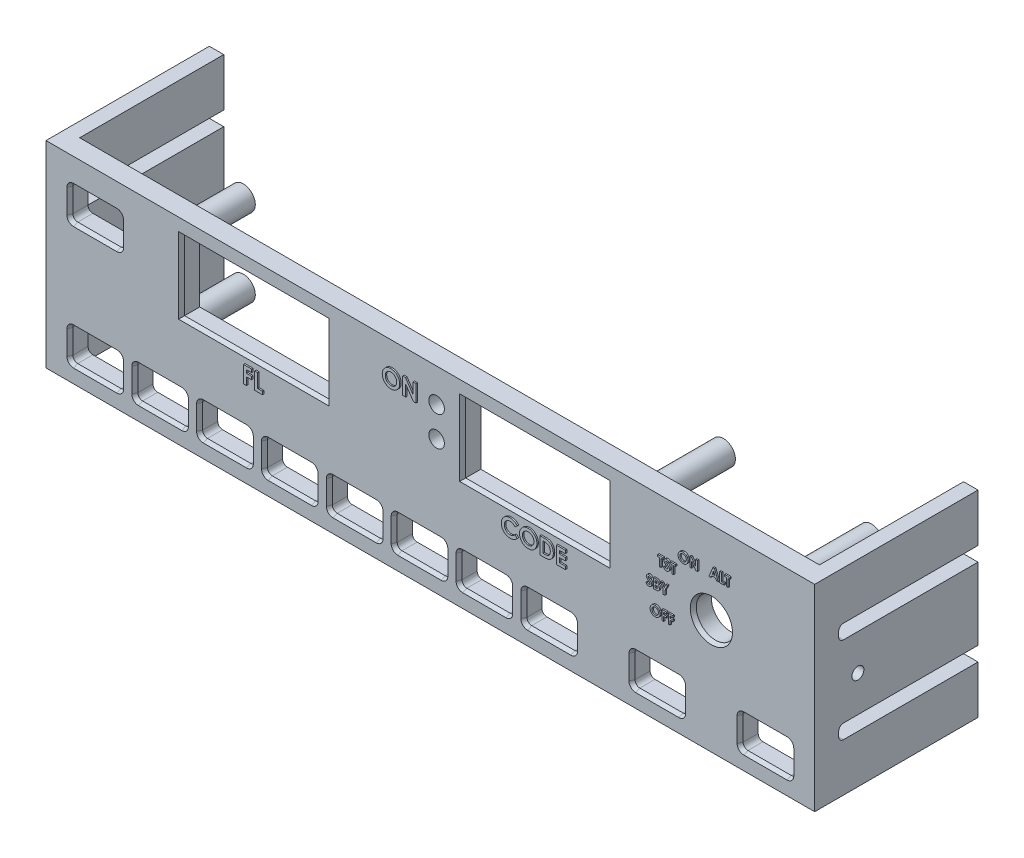
from build123d import *

# Parameters (mm, degrees)
ESQUISSE1_W             = 160
ESQUISSE1_H             = 41
BOSS_EXTRU_1_DEPTH      = 4
ESQUISSE2_R             = 4
ESQUISSE2_R_2           = 1.625
ESQUISSE2_W             = 30.5
ESQUISSE2_H             = 15
ENL_V_MAT_EXTRU_1_DEPTH = 4
ESQUISSE4_W             = 3
ESQUISSE4_H             = 41
BOSS_EXTRU_2_DEPTH      = 30
ENL_V_MAT_EXTRU_2_DEPTH = 168.871975029
ESQUISSE7_R             = 2.5
ESQUISSE7_R_2           = 1.25
BOSS_EXTRU_3_DEPTH      = 15
CHANFREIN1_SIZE         = 0.4
CHANFREIN1_SIZE2        = 0.857802768
ESQUISSE9_R             = 1.25
ENL_V_MAT_EXTRU_3_DEPTH = 900
ENL_V_MAT_EXTRU_4_DEPTH = 0.3
BOSS_EXTRU_4_DEPTH      = 0.3
BOSS_EXTRU_4_2_DEPTH    = 0.3
BOSS_EXTRU_4_3_DEPTH    = 0.3
BOSS_EXTRU_4_4_DEPTH    = 0.3
BOSS_EXTRU_4_5_DEPTH    = 0.3
BOSS_EXTRU_4_6_DEPTH    = 0.3
BOSS_EXTRU_4_7_DEPTH    = 0.3
BOSS_EXTRU_4_8_DEPTH    = 0.3
BOSS_EXTRU_4_9_DEPTH    = 0.3
BOSS_EXTRU_4_10_DEPTH   = 0.3
BOSS_EXTRU_4_11_DEPTH   = 0.3
BOSS_EXTRU_4_12_DEPTH   = 0.3
BOSS_EXTRU_4_13_DEPTH   = 0.3
BOSS_EXTRU_4_14_DEPTH   = 0.3
BOSS_EXTRU_4_15_DEPTH   = 0.3
BOSS_EXTRU_4_16_DEPTH   = 0.3
BOSS_EXTRU_4_17_DEPTH   = 0.3
BOSS_EXTRU_4_18_DEPTH   = 0.3
BOSS_EXTRU_4_19_DEPTH   = 0.3
BOSS_EXTRU_4_20_DEPTH   = 0.3
BOSS_EXTRU_4_21_DEPTH   = 0.3
BOSS_EXTRU_4_22_DEPTH   = 0.3


with BuildPart() as part:
    # Esquisse1 → Boss.-Extru.1 (new body)
    with BuildSketch(Plane.XY):
        with Locations((80, 20.5)):
            Rectangle(ESQUISSE1_W, ESQUISSE1_H)
    extrude(amount=BOSS_EXTRU_1_DEPTH)

    # Esquisse2 → Enlèv. mat.-Extru.1 (cut)
    with BuildSketch(Plane.XY.offset(4)):
        with Locations((138.5, 23.75)):
            Circle(ESQUISSE2_R)
        with Locations((81.3, 34.05)):
            Circle(ESQUISSE2_R_2)
        with Locations((81.3, 27.83)):
            Circle(ESQUISSE2_R_2)
        with BuildLine():
            Line((19.25, 10.25), (28.25, 10.25))
            ThreePointArc((28.25, 10.25), (28.957106781, 9.957106781), (29.25, 9.25))
            Line((29.25, 9.25), (29.25, 4.25))
            ThreePointArc((29.25, 4.25), (28.957106781, 3.542893219), (28.25, 3.25))
            Line((28.25, 3.25), (19.25, 3.25))
            ThreePointArc((19.25, 3.25), (18.542893219, 3.542893219), (18.25, 4.25))
            Line((18.25, 4.25), (18.25, 9.25))
            ThreePointArc((18.25, 9.25), (18.542893219, 9.957106781), (19.25, 10.25))
        make_face()
        with BuildLine():
            Line((5.75, 3.25), (14.75, 3.25))
            ThreePointArc((14.75, 3.25), (15.457106781, 3.542893219), (15.75, 4.25))
            Line((15.75, 4.25), (15.75, 9.25))
            ThreePointArc((15.75, 9.25), (15.457106781, 9.957106781), (14.75, 10.25))
            Line((14.75, 10.25), (5.75, 10.25))
            ThreePointArc((5.75, 10.25), (5.042893219, 9.957106781), (4.75, 9.25))
            Line((4.75, 9.25), (4.75, 4.25))
            ThreePointArc((4.75, 4.25), (5.042893219, 3.542893219), (5.75, 3.25))
        make_face()
        with BuildLine():
            Line((32.75, 10.25), (41.75, 10.25))
            ThreePointArc((41.75, 10.25), (42.457106781, 9.957106781), (42.75, 9.25))
            Line((42.75, 9.25), (42.75, 4.25))
            ThreePointArc((42.75, 4.25), (42.457106781, 3.542893219), (41.75, 3.25))
            Line((41.75, 3.25), (32.75, 3.25))
            ThreePointArc((32.75, 3.25), (32.042893219, 3.542893219), (31.75, 4.25))
            Line((31.75, 4.25), (31.75, 9.25))
            ThreePointArc((31.75, 9.25), (32.042893219, 9.957106781), (32.75, 10.25))
        make_face()
        with BuildLine():
            Line((46.25, 10.25), (55.25, 10.25))
            ThreePointArc((55.25, 10.25), (55.957106781, 9.957106781), (56.25, 9.25))
            Line((56.25, 9.25), (56.25, 4.25))
            ThreePointArc((56.25, 4.25), (55.957106781, 3.542893219), (55.25, 3.25))
            Line((55.25, 3.25), (46.25, 3.25))
            ThreePointArc((46.25, 3.25), (45.542893219, 3.542893219), (45.25, 4.25))
            Line((45.25, 4.25), (45.25, 9.25))
            ThreePointArc((45.25, 9.25), (45.542893219, 9.957106781), (46.25, 10.25))
        make_face()
        with BuildLine():
            Line((59.75, 10.25), (68.75, 10.25))
            ThreePointArc((68.75, 10.25), (69.457106781, 9.957106781), (69.75, 9.25))
            Line((69.75, 9.25), (69.75, 4.25))
            ThreePointArc((69.75, 4.25), (69.457106781, 3.542893219), (68.75, 3.25))
            Line((68.75, 3.25), (59.75, 3.25))
            ThreePointArc((59.75, 3.25), (59.042893219, 3.542893219), (58.75, 4.25))
            Line((58.75, 4.25), (58.75, 9.25))
            ThreePointArc((58.75, 9.25), (59.042893219, 9.957106781), (59.75, 10.25))
        make_face()
        with BuildLine():
            Line((73.25, 10.25), (82.25, 10.25))
            ThreePointArc((82.25, 10.25), (82.957106781, 9.957106781), (83.25, 9.25))
            Line((83.25, 9.25), (83.25, 4.25))
            ThreePointArc((83.25, 4.25), (82.957106781, 3.542893219), (82.25, 3.25))
            Line((82.25, 3.25), (73.25, 3.25))
            ThreePointArc((73.25, 3.25), (72.542893219, 3.542893219), (72.25, 4.25))
            Line((72.25, 4.25), (72.25, 9.25))
            ThreePointArc((72.25, 9.25), (72.542893219, 9.957106781), (73.25, 10.25))
        make_face()
        with BuildLine():
            Line((86.75, 10.25), (95.75, 10.25))
            ThreePointArc((95.75, 10.25), (96.457106781, 9.957106781), (96.75, 9.25))
            Line((96.75, 9.25), (96.75, 4.25))
            ThreePointArc((96.75, 4.25), (96.457106781, 3.542893219), (95.75, 3.25))
            Line((95.75, 3.25), (86.75, 3.25))
            ThreePointArc((86.75, 3.25), (86.042893219, 3.542893219), (85.75, 4.25))
            Line((85.75, 4.25), (85.75, 9.25))
            ThreePointArc((85.75, 9.25), (86.042893219, 9.957106781), (86.75, 10.25))
        make_face()
        with BuildLine():
            Line((100.25, 10.25), (109.25, 10.25))
            ThreePointArc((109.25, 10.25), (109.957106781, 9.957106781), (110.25, 9.25))
            Line((110.25, 9.25), (110.25, 4.25))
            ThreePointArc((110.25, 4.25), (109.957106781, 3.542893219), (109.25, 3.25))
            Line((109.25, 3.25), (100.25, 3.25))
            ThreePointArc((100.25, 3.25), (99.542893219, 3.542893219), (99.25, 4.25))
            Line((99.25, 4.25), (99.25, 9.25))
            ThreePointArc((99.25, 9.25), (99.542893219, 9.957106781), (100.25, 10.25))
        make_face()
        with BuildLine():
            Line((122.75, 3.25), (131.75, 3.25))
            ThreePointArc((131.75, 3.25), (132.457106781, 3.542893219), (132.75, 4.25))
            Line((132.75, 4.25), (132.75, 9.25))
            ThreePointArc((132.75, 9.25), (132.457106781, 9.957106781), (131.75, 10.25))
            Line((131.75, 10.25), (122.75, 10.25))
            ThreePointArc((122.75, 10.25), (122.042893219, 9.957106781), (121.75, 9.25))
            Line((121.75, 9.25), (121.75, 4.25))
            ThreePointArc((121.75, 4.25), (122.042893219, 3.542893219), (122.75, 3.25))
        make_face()
        with BuildLine():
            Line((145.25, 3.25), (154.25, 3.25))
            ThreePointArc((154.25, 3.25), (154.957106781, 3.542893219), (155.25, 4.25))
            Line((155.25, 4.25), (155.25, 9.25))
            ThreePointArc((155.25, 9.25), (154.957106781, 9.957106781), (154.25, 10.25))
            Line((154.25, 10.25), (145.25, 10.25))
            ThreePointArc((145.25, 10.25), (144.542893219, 9.957106781), (144.25, 9.25))
            Line((144.25, 9.25), (144.25, 4.25))
            ThreePointArc((144.25, 4.25), (144.542893219, 3.542893219), (145.25, 3.25))
        make_face()
        with BuildLine():
            Line((5.75, 35.75), (14.75, 35.75))
            ThreePointArc((14.75, 35.75), (15.457106781, 35.457106781), (15.75, 34.75))
            Line((15.75, 34.75), (15.75, 29.75))
            ThreePointArc((15.75, 29.75), (15.457106781, 29.042893219), (14.75, 28.75))
            Line((14.75, 28.75), (5.75, 28.75))
            ThreePointArc((5.75, 28.75), (5.042893219, 29.042893219), (4.75, 29.75))
            Line((4.75, 29.75), (4.75, 34.75))
            ThreePointArc((4.75, 34.75), (5.042893219, 35.457106781), (5.75, 35.75))
        make_face()
        with Locations((43.25, 30.5)):
            Rectangle(ESQUISSE2_W, ESQUISSE2_H)
        with Locations((101.75, 30.5)):
            Rectangle(ESQUISSE2_W, ESQUISSE2_H)
    extrude(amount=-ENL_V_MAT_EXTRU_1_DEPTH, mode=Mode.SUBTRACT)

    # Esquisse4 → Boss.-Extru.2 (add)
    with BuildSketch(Plane(origin=(0, 0, 0), x_dir=(-1, 0, 0), z_dir=(0, 0, -1))):
        with Locations((-158.5, 20.5)):
            Rectangle(ESQUISSE4_W, ESQUISSE4_H)
        with Locations((-1.5, 20.5)):
            Rectangle(ESQUISSE4_W, ESQUISSE4_H)
    extrude(amount=BOSS_EXTRU_2_DEPTH)

    # Esquisse5 → Enlèv. mat.-Extru.2 (cut, through all)
    with BuildSketch(Plane(origin=(160, 0, 0), x_dir=(0, 0, -1), z_dir=(1, 0, 0))):
        with BuildLine():
            Line((30, 13), (2, 13))
            ThreePointArc((2, 13), (1.292893219, 12.707106781), (1, 12))
            Line((1, 12), (1, 11))
            ThreePointArc((1, 11), (1.292893219, 10.292893219), (2, 10))
            Line((2, 10), (30, 10))
            Line((30, 10), (30, 13))
        make_face()
        with BuildLine():
            Line((30, 31), (2, 31))
            ThreePointArc((2, 31), (1.292893219, 30.707106781), (1, 30))
            Line((1, 30), (1, 29))
            ThreePointArc((1, 29), (1.292893219, 28.292893219), (2, 28))
            Line((2, 28), (30, 28))
            Line((30, 28), (30, 31))
        make_face()
    extrude(amount=-ENL_V_MAT_EXTRU_2_DEPTH, mode=Mode.SUBTRACT)

    # Esquisse7 → Boss.-Extru.3 (add)
    # profile 1 of 7: a face of its own
    with BuildSketch(Plane(origin=(0, 0, 0), x_dir=(-1, 0, 0), z_dir=(0, 0, -1))):
        with Locations((-22.066417501, 32.220467417)):
            Circle(ESQUISSE7_R)
        with Locations((-22.066417501, 32.220467417)):
            Circle(ESQUISSE7_R_2, mode=Mode.SUBTRACT)
    # profile 2 of 7: a face of its own
    with BuildSketch(Plane(origin=(0, 0, 0), x_dir=(-1, 0, 0), z_dir=(0, 0, -1))):
        with Locations((-22.066417501, 15.960655172)):
            Circle(ESQUISSE7_R)
        with Locations((-22.066417501, 15.960655172)):
            Circle(ESQUISSE7_R_2, mode=Mode.SUBTRACT)
    # profile 3 of 7: a face of its own
    with BuildSketch(Plane(origin=(0, 0, 0), x_dir=(-1, 0, 0), z_dir=(0, 0, -1))):
        with Locations((-152.81245368, 36.297265299)):
            Circle(ESQUISSE7_R)
        with Locations((-152.81245368, 36.297265299)):
            Circle(ESQUISSE7_R_2, mode=Mode.SUBTRACT)
    # profile 4 of 7: a face of its own
    with BuildSketch(Plane(origin=(0, 0, 0), x_dir=(-1, 0, 0), z_dir=(0, 0, -1))):
        with Locations((-152.81245368, 14.495559759)):
            Circle(ESQUISSE7_R)
        with Locations((-152.81245368, 14.495559759)):
            Circle(ESQUISSE7_R_2, mode=Mode.SUBTRACT)
    # profile 5 of 7: a face of its own
    with BuildSketch(Plane(origin=(0, 0, 0), x_dir=(-1, 0, 0), z_dir=(0, 0, -1))):
        with Locations((-122, 36.297265299)):
            Circle(ESQUISSE7_R)
        with Locations((-122, 36.297265299)):
            Circle(ESQUISSE7_R_2, mode=Mode.SUBTRACT)
    # profile 6 of 7: a face of its own
    with BuildSketch(Plane(origin=(0, 0, 0), x_dir=(-1, 0, 0), z_dir=(0, 0, -1))):
        with Locations((-116.25, 6.75)):
            Circle(ESQUISSE7_R)
        with Locations((-116.25, 6.75)):
            Circle(ESQUISSE7_R_2, mode=Mode.SUBTRACT)
    # profile 7 of 7: a face of its own
    with BuildSketch(Plane(origin=(0, 0, 0), x_dir=(-1, 0, 0), z_dir=(0, 0, -1))):
        with Locations((-63.5, 14.495559759)):
            Circle(ESQUISSE7_R)
        with Locations((-63.5, 14.495559759)):
            Circle(ESQUISSE7_R_2, mode=Mode.SUBTRACT)
    extrude(amount=BOSS_EXTRU_3_DEPTH)

    # Chanfrein1
    chanfrein1_edges = [part.edges().sort_by_distance(p)[0] for p in [
        (59.042893219, 3.542893219, 4),
        (64.25, 3.25, 4),
        (69.457106781, 3.542893219, 4),
        (69.75, 6.75, 4),
        (69.457106781, 9.957106781, 4),
        (64.25, 10.25, 4),
        (59.042893219, 9.957106781, 4),
        (58.75, 6.75, 4),
        (72.542893219, 3.542893219, 4),
        (77.75, 3.25, 4),
        (82.957106781, 3.542893219, 4),
        (83.25, 6.75, 4),
        (82.957106781, 9.957106781, 4),
        (77.75, 10.25, 4),
        (72.542893219, 9.957106781, 4),
        (72.25, 6.75, 4),
        (86.042893219, 3.542893219, 4),
        (91.25, 3.25, 4),
        (96.457106781, 3.542893219, 4),
        (96.75, 6.75, 4),
        (96.457106781, 9.957106781, 4),
        (91.25, 10.25, 4),
        (86.042893219, 9.957106781, 4),
        (85.75, 6.75, 4),
        (99.542893219, 3.542893219, 4),
        (104.75, 3.25, 4),
        (109.957106781, 3.542893219, 4),
        (110.25, 6.75, 4),
        (109.957106781, 9.957106781, 4),
        (104.75, 10.25, 4),
        (99.542893219, 9.957106781, 4),
        (99.25, 6.75, 4),
        (154.957106781, 3.542893219, 4),
        (155.25, 6.75, 4),
        (154.957106781, 9.957106781, 4),
        (149.75, 10.25, 4),
        (144.542893219, 9.957106781, 4),
        (144.25, 6.75, 4),
        (144.542893219, 3.542893219, 4),
        (149.75, 3.25, 4),
        (132.457106781, 3.542893219, 4),
        (132.75, 6.75, 4),
        (132.457106781, 9.957106781, 4),
        (127.25, 10.25, 4),
        (122.042893219, 9.957106781, 4),
        (121.75, 6.75, 4),
        (122.042893219, 3.542893219, 4),
        (127.25, 3.25, 4),
        (5.042893219, 3.542893219, 4),
        (10.25, 3.25, 4),
        (15.457106781, 3.542893219, 4),
        (15.75, 6.75, 4),
        (15.457106781, 9.957106781, 4),
        (10.25, 10.25, 4),
        (5.042893219, 9.957106781, 4),
        (4.75, 6.75, 4),
        (15.457106781, 35.457106781, 4),
        (10.25, 35.75, 4),
        (5.042893219, 35.457106781, 4),
        (4.75, 32.25, 4),
        (5.042893219, 29.042893219, 4),
        (10.25, 28.75, 4),
        (15.457106781, 29.042893219, 4),
        (15.75, 32.25, 4),
        (134.5, 23.75, 4),
        (28, 30.5, 4),
        (43.25, 23, 4),
        (58.5, 30.5, 4),
        (43.25, 38, 4),
        (86.5, 30.5, 4),
        (101.75, 23, 4),
        (117, 30.5, 4),
        (101.75, 38, 4),
        (18.542893219, 3.542893219, 4),
        (23.75, 3.25, 4),
        (28.957106781, 3.542893219, 4),
        (29.25, 6.75, 4),
        (28.957106781, 9.957106781, 4),
        (23.75, 10.25, 4),
        (18.542893219, 9.957106781, 4),
        (18.25, 6.75, 4),
        (32.042893219, 3.542893219, 4),
        (37.25, 3.25, 4),
        (42.457106781, 3.542893219, 4),
        (42.75, 6.75, 4),
        (42.457106781, 9.957106781, 4),
        (37.25, 10.25, 4),
        (32.042893219, 9.957106781, 4),
        (31.75, 6.75, 4),
        (45.542893219, 3.542893219, 4),
        (50.75, 3.25, 4),
        (55.957106781, 3.542893219, 4),
        (56.25, 6.75, 4),
        (55.957106781, 9.957106781, 4),
        (50.75, 10.25, 4),
        (45.542893219, 9.957106781, 4),
        (45.25, 6.75, 4),
    ]]
    chanfrein1_side = [part.faces().sort_by_distance(p)[0] for p in [
        (82.954950779, 20.518610954, 4),
    ]]
    chamfer(chanfrein1_edges, length=CHANFREIN1_SIZE, length2=CHANFREIN1_SIZE2, reference=chanfrein1_side[0])

    # Esquisse9 → Enlèv. mat.-Extru.3 (cut)
    with BuildSketch(Plane(origin=(160, 0, 0), x_dir=(0, 0, -1), z_dir=(1, 0, 0))):
        with Locations((5, 20.5)):
            Circle(ESQUISSE9_R)
    extrude(amount=-ENL_V_MAT_EXTRU_3_DEPTH, mode=Mode.SUBTRACT)

    # Esquisse8 → Enlèv. mat.-Extru.4 (cut)
    # profile 1 of 22: a face of its own
    with BuildSketch(Plane.XY.offset(4)):
        Polygon((129.825536536, 20.885193728), (130.799895511, 20.885193728), (130.799895511, 20.526219369), (130.184510895, 20.526219369), (130.184510895, 20.141603984), (130.799895511, 20.141603984), (130.799895511, 19.782629625), (130.184510895, 19.782629625), (130.184510895, 18.885193728), (129.825536536, 18.885193728), align=None)
    # profile 2 of 22: a face of its own
    with BuildSketch(Plane.XY.offset(4)):
        Polygon((128.492203203, 20.885193728), (129.466562177, 20.885193728), (129.466562177, 20.526219369), (128.851177562, 20.526219369), (128.851177562, 20.141603984), (129.466562177, 20.141603984), (129.466562177, 19.782629625), (128.851177562, 19.782629625), (128.851177562, 18.885193728), (128.492203203, 18.885193728), align=None)
    # profile 3 of 22: a face of its own
    with BuildSketch(Plane.XY.offset(4)):
        with BuildLine():
            add(Edge.make_bspline(
                [(127.098773716, 20.936475779), (127.133546167, 20.935575458), (127.202194861, 20.933798021), (127.303152318, 20.918981691), (127.400443494, 20.894840605), (127.494024396, 20.86128275), (127.583660706, 20.817399209), (127.669668603, 20.764434108), (127.751740011, 20.701387763), (127.829033926, 20.629730941), (127.900467445, 20.551807276), (127.96236463, 20.467908597), (128.015148279, 20.380208803), (128.058895508, 20.2884729), (128.092217166, 20.192065573), (128.115600352, 20.091478371), (128.13062289, 19.986739912), (128.132350713, 19.915427297), (128.133228844, 19.879184112)],
                knots=[0, 0, 0, 0, 1.014329547, 2.002516266, 2.970391464, 3.935626869, 4.897733899, 5.877609409, 6.878433252, 7.912639331, 8.949961323, 9.958554974, 10.949718813, 11.932905612, 12.9188844, 13.919928257, 14.942845884, 16, 16, 16, 16], degree=3))
            add(Edge.make_bspline(
                [(128.133228844, 19.879184112), (128.132293673, 19.843349305), (128.130450887, 19.772735667), (128.116213638, 19.668962413), (128.092436676, 19.56945271), (128.05968018, 19.473981315), (128.01672636, 19.383010659), (127.964972049, 19.295959906), (127.903051551, 19.213636909), (127.833223349, 19.136085844), (127.756348557, 19.065691613), (127.67492595, 19.003656818), (127.589331485, 18.951090873), (127.499690447, 18.908017858), (127.405810603, 18.874590476), (127.307923849, 18.85100503), (127.206036242, 18.836671678), (127.136747728, 18.834840929), (127.101578203, 18.833911677)],
                knots=[0, 0, 0, 0, 1.051557043, 2.072126891, 3.067553643, 4.050577992, 5.02905126, 6.015227836, 7.017913613, 8.04756643, 9.074058332, 10.072836633, 11.047628519, 12.017157415, 12.98668631, 13.966869689, 14.968021931, 16, 16, 16, 16], degree=3))
            add(Edge.make_bspline(
                [(127.101578203, 18.833911677), (127.064795097, 18.834745262), (126.992521322, 18.836383144), (126.886748328, 18.851958652), (126.785408661, 18.875420808), (126.689353631, 18.910436818), (126.597605001, 18.954209774), (126.510836874, 19.008118794), (126.42907841, 19.072074789), (126.35279859, 19.144439823), (126.283688888, 19.223623041), (126.22268602, 19.307273089), (126.171228748, 19.394750955), (126.129315189, 19.486097579), (126.096272222, 19.580745264), (126.072964163, 19.679270443), (126.059195537, 19.781436817), (126.057277647, 19.85083026), (126.056305767, 19.88599501)],
                knots=[0, 0, 0, 0, 1.067978421, 2.098431617, 3.099715153, 4.085208694, 5.062210972, 6.048429807, 7.046490867, 8.072918869, 9.098532598, 10.095778865, 11.076610158, 12.041847152, 13.011192615, 13.984257998, 14.978533688, 16, 16, 16, 16], degree=3))
            add(Edge.make_bspline(
                [(126.056305767, 19.88599501), (126.056610799, 19.909652013), (126.057217001, 19.956666467), (126.064519337, 20.026339489), (126.075032603, 20.094652587), (126.090581223, 20.161333395), (126.109468823, 20.226852317), (126.133940376, 20.290599485), (126.161795627, 20.353255894), (126.194341864, 20.414081495), (126.230530134, 20.472516641), (126.270014757, 20.528285682), (126.312895019, 20.58071429), (126.359032787, 20.630147004), (126.408587059, 20.676258898), (126.460905999, 20.719702752), (126.51700429, 20.759324542), (126.575654116, 20.796091911), (126.636524823, 20.829340005), (126.699368613, 20.857639788), (126.762890779, 20.882353507), (126.827939891, 20.901858666), (126.893818832, 20.917745415), (126.961231386, 20.928251594), (127.029568519, 20.935553728), (127.075650571, 20.936167699), (127.098773716, 20.936475779)],
                knots=[0, 0, 0, 0, 1.034744296, 2.056386356, 3.06226378, 4.057406941, 5.050368692, 6.043467995, 7.042652155, 8.049140477, 9.059438543, 10.048523776, 11.036952808, 12.020949711, 13.004946614, 13.997082645, 14.994316842, 16.007702937, 17.024872941, 18.026463647, 19.021641123, 20.005082605, 20.995858141, 21.984425357, 22.988620895, 24, 24, 24, 24], degree=3))
        make_face()
        with BuildLine():
            add(Edge.make_bspline(
                [(127.093164741, 20.57750142), (127.069762886, 20.576873496), (127.023576989, 20.575634225), (126.955830689, 20.566192653), (126.890791849, 20.551113391), (126.828821004, 20.529271263), (126.769649567, 20.501471778), (126.713172647, 20.467812071), (126.660172331, 20.427135126), (126.609941911, 20.381624708), (126.564566993, 20.330915643), (126.524476821, 20.276572257), (126.490927804, 20.2186853), (126.462830292, 20.15779253), (126.441679093, 20.093209224), (126.426613728, 20.025441269), (126.41709298, 19.954371898), (126.415892878, 19.905924001), (126.415280126, 19.881187318)],
                knots=[0, 0, 0, 0, 1.033739768, 2.040188636, 3.016340934, 3.979330865, 4.937572243, 5.900995986, 6.878200029, 7.884839167, 8.891893314, 9.879764717, 10.863503415, 11.843163062, 12.837761627, 13.859916423, 14.907309254, 16, 16, 16, 16], degree=3))
            add(Edge.make_bspline(
                [(126.415280126, 19.881187318), (126.416092542, 19.853773508), (126.417684742, 19.800046984), (126.428887654, 19.721672178), (126.448054723, 19.647654953), (126.475731597, 19.578357315), (126.510058183, 19.513009767), (126.552686354, 19.452413234), (126.602925736, 19.396204895), (126.641629749, 19.363388125), (126.661273716, 19.346732189)],
                knots=[0, 0, 0, 0, 1.078454662, 2.113592447, 3.107694534, 4.079536787, 5.043276885, 6.005368276, 6.987637804, 8, 8, 8, 8], degree=3))
            add(Edge.make_bspline(
                [(126.661273716, 19.346732189), (126.677365875, 19.334427424), (126.709187634, 19.310095122), (126.75998209, 19.278908285), (126.812290378, 19.252178054), (126.866507229, 19.230580344), (126.92251814, 19.213591948), (126.980315431, 19.201695254), (127.039817207, 19.19422905), (127.080055096, 19.193336697), (127.10037628, 19.192886036)],
                knots=[0, 0, 0, 0, 1.023928204, 2.024787132, 3.009472467, 3.9914905, 4.972207045, 5.96565515, 6.972602802, 8, 8, 8, 8], degree=3))
            add(Edge.make_bspline(
                [(127.10037628, 19.192886036), (127.123375739, 19.193519284), (127.168627899, 19.19476522), (127.235113065, 19.204090561), (127.298807874, 19.219872403), (127.360107747, 19.241522924), (127.418835925, 19.269671456), (127.474705385, 19.304375181), (127.527814082, 19.345207985), (127.577980509, 19.391316054), (127.623834994, 19.442224878), (127.663841507, 19.496858127), (127.698457214, 19.554012067), (127.725970438, 19.614495626), (127.747957273, 19.677737868), (127.762841318, 19.744018878), (127.772442495, 19.813065421), (127.773642936, 19.860054034), (127.774254485, 19.883991805)],
                knots=[0, 0, 0, 0, 1.026359118, 2.019393844, 2.989460624, 3.950973911, 4.916101784, 5.890408035, 6.881132271, 7.902007068, 8.92769091, 9.933912415, 10.920395702, 11.90457117, 12.894218921, 13.903490204, 14.931958862, 16, 16, 16, 16], degree=3))
            add(Edge.make_bspline(
                [(127.774254485, 19.883991805), (127.773621776, 19.907791927), (127.772376384, 19.954638838), (127.763034631, 20.023507863), (127.747352872, 20.089496262), (127.725637337, 20.152711801), (127.697907749, 20.213216454), (127.6636173, 20.270797452), (127.622886311, 20.325399127), (127.576652204, 20.376649391), (127.52632922, 20.4237451), (127.472302468, 20.464615615), (127.416083678, 20.500130792), (127.356382916, 20.527951949), (127.294421611, 20.550117005), (127.229821669, 20.56643967), (127.162338416, 20.575567897), (127.116428164, 20.576851168), (127.093164741, 20.57750142)],
                knots=[0, 0, 0, 0, 1.055025985, 2.07665775, 3.074803781, 4.057872707, 5.035505728, 6.020516407, 7.023567878, 8.050795229, 9.077271434, 10.074415901, 11.050397877, 12.019801805, 12.988065821, 13.964604439, 14.968634123, 16, 16, 16, 16], degree=3))
        make_face(mode=Mode.SUBTRACT)
    # profile 4 of 22: a face of its own
    with BuildSketch(Plane.XY.offset(4)):
        with BuildLine():
            Line((126.343168247, 25.482772436), (126.07473876, 25.237179487))
            add(Edge.make_bspline(
                [(126.07473876, 25.237179487), (126.063240392, 25.253399131), (126.041165128, 25.284538585), (126.005383429, 25.326235048), (125.969763302, 25.361805234), (125.933974749, 25.391100547), (125.897700554, 25.413942997), (125.861003683, 25.430115703), (125.824092181, 25.440396846), (125.79929335, 25.441677096), (125.787078504, 25.442307692)],
                knots=[0, 0, 0, 0, 1.299362458, 2.494594718, 3.587462134, 4.587049575, 5.512617175, 6.380583204, 7.202344345, 8, 8, 8, 8], degree=3))
            add(Edge.make_bspline(
                [(125.787078504, 25.442307692), (125.775684845, 25.441908118), (125.753686684, 25.441136644), (125.722326673, 25.43346825), (125.694484808, 25.420233729), (125.670188263, 25.402928479), (125.650941815, 25.382079664), (125.635575018, 25.360214619), (125.62692222, 25.336080553), (125.625783342, 25.319504304), (125.625219529, 25.311298077)],
                knots=[0, 0, 0, 0, 1.185010067, 2.2879431, 3.333075148, 4.379039566, 5.372662701, 6.27520591, 7.14612461, 8, 8, 8, 8], degree=3))
            add(Edge.make_bspline(
                [(125.625219529, 25.311298077), (125.625572842, 25.302973513), (125.626284365, 25.286208997), (125.633156704, 25.261638511), (125.643515282, 25.237630287), (125.653413325, 25.223015338), (125.658472734, 25.215544872)],
                knots=[0, 0, 0, 0, 0.967525499, 1.948461899, 2.951351359, 4, 4, 4, 4], degree=3))
            add(Edge.make_bspline(
                [(125.658472734, 25.215544872), (125.663072285, 25.209738157), (125.673659841, 25.196371865), (125.693848144, 25.175201743), (125.719200412, 25.14926649), (125.750692254, 25.119457943), (125.787016357, 25.084704072), (125.82985639, 25.046371064), (125.877979231, 25.003271789), (125.912183831, 24.973259015), (125.93010735, 24.957532051)],
                knots=[0, 0, 0, 0, 0.473873513, 1.090794244, 1.870441696, 2.795289791, 3.865433203, 5.087734844, 6.473946851, 8, 8, 8, 8], degree=3))
            add(Edge.make_bspline(
                [(125.93010735, 24.957532051), (125.94693115, 24.942971901), (125.978859228, 24.91533976), (126.024286542, 24.876120373), (126.064209585, 24.840835647), (126.099209945, 24.810015129), (126.128757051, 24.783335443), (126.152975118, 24.76066906), (126.172159929, 24.742457252), (126.183065371, 24.731457309), (126.187719529, 24.726762821)],
                knots=[0, 0, 0, 0, 1.543621617, 2.929473131, 4.163658386, 5.240097082, 6.164993805, 6.925417477, 7.541396219, 8, 8, 8, 8], degree=3))
            add(Edge.make_bspline(
                [(126.187719529, 24.726762821), (126.205376435, 24.707654267), (126.239319208, 24.670920917), (126.283432847, 24.613995777), (126.319739799, 24.558425234), (126.347827546, 24.503163636), (126.369040542, 24.44741367), (126.383995985, 24.38980807), (126.392952899, 24.329744893), (126.393947326, 24.288759108), (126.394450299, 24.268028846)],
                knots=[0, 0, 0, 0, 1.206664779, 2.319633467, 3.337109185, 4.282041471, 5.190008762, 6.099243693, 7.03861361, 8, 8, 8, 8], degree=3))
            add(Edge.make_bspline(
                [(126.394450299, 24.268028846), (126.394092296, 24.247829748), (126.39338988, 24.208198366), (126.384786642, 24.150203742), (126.372518928, 24.09470037), (126.353550891, 24.042292204), (126.33043276, 23.992118982), (126.301450844, 23.944962242), (126.267415557, 23.900344738), (126.228405893, 23.859064064), (126.185256571, 23.821604713), (126.138974824, 23.788257514), (126.089108083, 23.760725154), (126.036082403, 23.738054219), (125.979926168, 23.720592762), (125.920706275, 23.707687118), (125.858332145, 23.699941354), (125.815679816, 23.699131626), (125.793889401, 23.698717949)],
                knots=[0, 0, 0, 0, 1.043214005, 2.046824704, 3.02475056, 3.976699089, 4.921714032, 5.875962561, 6.831408892, 7.817874052, 8.806269674, 9.781291748, 10.760897367, 11.74438705, 12.757449933, 13.795994037, 14.874007457, 16, 16, 16, 16], degree=3))
            add(Edge.make_bspline(
                [(125.793889401, 23.698717949), (125.776784111, 23.699021408), (125.742905827, 23.699622431), (125.692974357, 23.704529287), (125.644759879, 23.712448429), (125.598316701, 23.723798925), (125.55343559, 23.738181544), (125.510114701, 23.755749362), (125.468653092, 23.776774673), (125.428737047, 23.800825114), (125.390560607, 23.828750844), (125.353641044, 23.859980931), (125.318345079, 23.894995707), (125.284503193, 23.933712363), (125.252331916, 23.976240537), (125.220778167, 24.021987944), (125.191244288, 24.071803594), (125.172999898, 24.106749676), (125.163681068, 24.124599359)],
                knots=[0, 0, 0, 0, 1.016823716, 2.013894106, 2.979844003, 3.91962641, 4.853723003, 5.779685073, 6.695824784, 7.614987388, 8.547259901, 9.504950863, 10.487499108, 11.500346958, 12.559593716, 13.656357062, 14.802919212, 16, 16, 16, 16], degree=3))
            Line((125.163681068, 24.124599359), (125.479386196, 24.314102564))
            add(Edge.make_bspline(
                [(125.479386196, 24.314102564), (125.491042659, 24.293840842), (125.513389095, 24.254997389), (125.551257221, 24.202806287), (125.590051182, 24.158113247), (125.63066786, 24.121708221), (125.672613373, 24.093104429), (125.716090326, 24.072662175), (125.761129265, 24.060008442), (125.791807744, 24.058463129), (125.807110555, 24.057692308)],
                knots=[0, 0, 0, 0, 1.283663364, 2.460892379, 3.537111102, 4.529833553, 5.449777664, 6.316464042, 7.160231139, 8, 8, 8, 8], degree=3))
            add(Edge.make_bspline(
                [(125.807110555, 24.057692308), (125.822675704, 24.058321802), (125.85287436, 24.059543114), (125.895979078, 24.070823998), (125.935499115, 24.088535813), (125.969659943, 24.113808132), (125.998585178, 24.142976228), (126.019933662, 24.175427069), (126.033344924, 24.210538096), (126.034762819, 24.234928525), (126.03547594, 24.247195513)],
                knots=[0, 0, 0, 0, 1.13588714, 2.203786484, 3.234766741, 4.283437687, 5.291419208, 6.222934724, 7.106237994, 8, 8, 8, 8], degree=3))
            add(Edge.make_bspline(
                [(126.03547594, 24.247195513), (126.034817402, 24.258607949), (126.033479647, 24.281791221), (126.023626152, 24.316261017), (126.008222134, 24.350715138), (125.989998095, 24.37897534), (125.971452853, 24.402636841), (125.953719419, 24.423138461), (125.932124787, 24.445789163), (125.906723712, 24.470617438), (125.877851809, 24.497841856), (125.845484756, 24.527459752), (125.809251916, 24.559210227), (125.783642474, 24.580838337), (125.770251581, 24.592147436)],
                knots=[0, 0, 0, 0, 0.916159276, 1.861089862, 2.860218735, 3.940849679, 4.552606315, 5.27541173, 6.11797699, 7.06649574, 8.129236253, 9.306560635, 10.591630461, 12, 12, 12, 12], degree=3))
            add(Edge.make_bspline(
                [(125.770251581, 24.592147436), (125.74479496, 24.613686178), (125.695935999, 24.655025544), (125.626892089, 24.716082486), (125.564677344, 24.773145792), (125.509829118, 24.826920891), (125.461648558, 24.876414681), (125.420461965, 24.922029169), (125.386721793, 24.964116208), (125.351217536, 25.013965489), (125.317481394, 25.074710264), (125.288323794, 25.14779327), (125.269407573, 25.220867003), (125.267288274, 25.269924682), (125.26624517, 25.294070513)],
                knots=[0, 0, 0, 0, 1.345494975, 2.582412109, 3.71882943, 4.751509156, 5.681369928, 6.505683931, 7.230279997, 7.856715994, 8.973648664, 10.023341002, 11.027102913, 12, 12, 12, 12], degree=3))
            add(Edge.make_bspline(
                [(125.26624517, 25.294070513), (125.266678996, 25.31119344), (125.267533678, 25.344927446), (125.27515758, 25.394528386), (125.286551791, 25.442389125), (125.303099456, 25.488335047), (125.324576328, 25.5323086), (125.350659155, 25.574525056), (125.381752953, 25.614595862), (125.416793564, 25.652494455), (125.455399347, 25.687129457), (125.496654532, 25.717698316), (125.54032561, 25.743517218), (125.586145426, 25.764935873), (125.634397904, 25.781330493), (125.684727572, 25.792951816), (125.737206618, 25.799863809), (125.772901732, 25.800803414), (125.791084914, 25.801282051)],
                knots=[0, 0, 0, 0, 1.010766082, 1.991317756, 2.957454644, 3.913069143, 4.869106762, 5.843196583, 6.838735724, 7.860187025, 8.887984031, 9.89767229, 10.887916223, 11.879572884, 12.879850636, 13.892031539, 14.926195476, 16, 16, 16, 16], degree=3))
            add(Edge.make_bspline(
                [(125.791084914, 25.801282051), (125.814649418, 25.800420012), (125.861592417, 25.798702737), (125.930998995, 25.785274208), (125.998792438, 25.764156432), (126.053421665, 25.738680159), (126.096889121, 25.714001281), (126.130202866, 25.691280079), (126.164101394, 25.665251721), (126.198858077, 25.635834185), (126.233827081, 25.602473205), (126.270002742, 25.565962967), (126.306892123, 25.525987936), (126.330864372, 25.497429959), (126.343168247, 25.482772436)],
                knots=[0, 0, 0, 0, 1.282922637, 2.555718331, 3.837320111, 5.142675274, 5.830281639, 6.55870424, 7.337177975, 8.157850921, 9.037902056, 9.96903443, 10.957596896, 12, 12, 12, 12], degree=3))
        make_face()
    # profile 5 of 22: a face of its own
    with BuildSketch(Plane.XY.offset(4)):
        with BuildLine():
            Line((126.753424658, 23.75), (126.753424658, 25.75))
            Line((126.753424658, 25.75), (127.073937478, 25.75))
            add(Edge.make_bspline(
                [(127.073937478, 25.75), (127.09637538, 25.750002561), (127.139792294, 25.750007516), (127.20243157, 25.74780783), (127.260524208, 25.74496229), (127.313885336, 25.741778793), (127.362605777, 25.73629299), (127.406611445, 25.730511554), (127.445990262, 25.723539498), (127.470336044, 25.717285348), (127.481790042, 25.714342949)],
                knots=[0, 0, 0, 0, 1.311965854, 2.538629056, 3.664479157, 4.713267157, 5.663616078, 6.530575999, 7.308677837, 8, 8, 8, 8], degree=3))
            add(Edge.make_bspline(
                [(127.481790042, 25.714342949), (127.496830304, 25.710192642), (127.526344126, 25.702048407), (127.568617338, 25.685600773), (127.608719377, 25.667318062), (127.646601278, 25.646460908), (127.682030432, 25.622777506), (127.714872197, 25.596079899), (127.745834886, 25.567439727), (127.773819088, 25.536058797), (127.799112195, 25.502899031), (127.82108737, 25.467969118), (127.840180981, 25.431803159), (127.85546087, 25.393946031), (127.86697398, 25.354572074), (127.875394621, 25.313849423), (127.880852336, 25.27164922), (127.881368019, 25.242939043), (127.881629786, 25.228365385)],
                knots=[0, 0, 0, 0, 1.099996261, 2.158545794, 3.195537121, 4.207578794, 5.205712374, 6.197378256, 7.190519799, 8.17788031, 9.159561366, 10.129234751, 11.085776129, 12.040971148, 13.00380137, 13.975669004, 14.972423361, 16, 16, 16, 16], degree=3))
            add(Edge.make_bspline(
                [(127.881629786, 25.228365385), (127.880945342, 25.209642059), (127.8795981, 25.172787494), (127.870991823, 25.118654806), (127.854853714, 25.067491635), (127.83373739, 25.018355063), (127.805025791, 24.97142837), (127.768567613, 24.926733869), (127.72495336, 24.882895348), (127.69149882, 24.856617112), (127.674097734, 24.842948718)],
                knots=[0, 0, 0, 0, 0.986156485, 1.941127874, 2.875419072, 3.804401753, 4.751181392, 5.761612777, 6.835722519, 8, 8, 8, 8], degree=3))
            add(Edge.make_bspline(
                [(127.674097734, 24.842948718), (127.688198739, 24.835750277), (127.715846909, 24.821636127), (127.755099187, 24.798436676), (127.791442511, 24.773761118), (127.825039835, 24.748105935), (127.855186416, 24.720383566), (127.883127056, 24.692191413), (127.90748331, 24.661914182), (127.929263407, 24.630631011), (127.948194312, 24.597888916), (127.964681044, 24.563743192), (127.978606794, 24.528077189), (127.99039948, 24.491072419), (127.999194469, 24.452601601), (128.004928988, 24.412650978), (128.009319694, 24.371356802), (128.00966125, 24.34322824), (128.009834914, 24.328926282)],
                knots=[0, 0, 0, 0, 1.164658916, 2.283573913, 3.35186032, 4.395461096, 5.390182219, 6.362969632, 7.312859996, 8.245001507, 9.165155236, 10.092416118, 11.032087915, 11.979892451, 12.947605196, 13.931445124, 14.948243989, 16, 16, 16, 16], degree=3))
            add(Edge.make_bspline(
                [(128.009834914, 24.328926282), (128.008707951, 24.301610361), (128.006483895, 24.2477025), (127.990222684, 24.168553379), (127.962030909, 24.093512834), (127.924175169, 24.022879107), (127.877529615, 23.958696929), (127.823900603, 23.902473899), (127.763828056, 23.854882352), (127.70840387, 23.82276175), (127.660466314, 23.801205822), (127.620760532, 23.787878588), (127.578117364, 23.775532259), (127.531755689, 23.766862412), (127.482515982, 23.758926814), (127.429918151, 23.754027212), (127.374060502, 23.750706872), (127.335695054, 23.750240388), (127.315924658, 23.75)],
                knots=[0, 0, 0, 0, 1.284142165, 2.534249414, 3.780121997, 5.041676246, 6.291546858, 7.49970053, 8.684500223, 9.883330709, 10.50184324, 11.153274765, 11.851151195, 12.587658647, 13.369265475, 14.195992086, 15.070362669, 16, 16, 16, 16], degree=3))
            Line((127.315924658, 23.75), (126.753424658, 23.75))
        make_face()
        with BuildLine():
            Line((127.112399016, 25.391025641), (127.112399016, 24.955128205))
            Line((127.112399016, 24.955128205), (127.207751581, 24.955128205))
            add(Edge.make_bspline(
                [(127.207751581, 24.955128205), (127.220710851, 24.955241215), (127.245727938, 24.955459373), (127.281862466, 24.958269179), (127.315461741, 24.963062881), (127.34639833, 24.969751301), (127.374960417, 24.97824462), (127.400965539, 24.988463912), (127.424299356, 25.000932559), (127.451407856, 25.019505159), (127.480063495, 25.04683557), (127.505288731, 25.086320013), (127.520146227, 25.131726972), (127.521800951, 25.163751475), (127.522655427, 25.180288462)],
                knots=[0, 0, 0, 0, 1.065314748, 2.056525647, 2.977365736, 3.853934255, 4.656397591, 5.425096493, 6.14721249, 6.826394842, 8.123232004, 9.372140726, 10.643011755, 12, 12, 12, 12], degree=3))
            add(Edge.make_bspline(
                [(127.522655427, 25.180288462), (127.52197169, 25.195778097), (127.520649712, 25.225726686), (127.505690124, 25.267777171), (127.482454926, 25.305042507), (127.45502251, 25.330547582), (127.429189559, 25.347966796), (127.407069801, 25.359436607), (127.382791706, 25.369704265), (127.355885275, 25.377555166), (127.32650416, 25.383446205), (127.29479108, 25.387772469), (127.26069132, 25.390717107), (127.237138544, 25.39092059), (127.224979145, 25.391025641)],
                knots=[0, 0, 0, 0, 1.347982417, 2.606269829, 3.849316587, 5.153353503, 5.842674298, 6.568177932, 7.326619318, 8.142485038, 9.012069166, 9.942760135, 10.937925643, 12, 12, 12, 12], degree=3))
            Line((127.224979145, 25.391025641), (127.112399016, 25.391025641))
        make_face(mode=Mode.SUBTRACT)
        with BuildLine():
            Line((127.112399016, 24.621794872), (127.112399016, 24.108974359))
            Line((127.112399016, 24.108974359), (127.215764401, 24.108974359))
            add(Edge.make_bspline(
                [(127.215764401, 24.108974359), (127.236199869, 24.109091106), (127.275489607, 24.109315567), (127.331772086, 24.112027587), (127.382946931, 24.116915526), (127.428878546, 24.123017724), (127.469637285, 24.131285248), (127.505085374, 24.141796345), (127.535708937, 24.153360382), (127.561324354, 24.167643341), (127.582250683, 24.184265164), (127.6011345, 24.201253066), (127.616531188, 24.220850216), (127.628713335, 24.242215362), (127.639256961, 24.264817779), (127.645616132, 24.289540084), (127.650457782, 24.315649566), (127.650724231, 24.33370893), (127.650860555, 24.342948718)],
                knots=[0, 0, 0, 0, 1.753078804, 3.370512758, 4.83203934, 6.162291463, 7.344201807, 8.395507345, 9.331626367, 10.147333109, 10.898971645, 11.62040215, 12.321813352, 13.025280112, 13.727906689, 14.453419512, 15.208716525, 16, 16, 16, 16], degree=3))
            add(Edge.make_bspline(
                [(127.650860555, 24.342948718), (127.650559921, 24.353514561), (127.649974366, 24.374093981), (127.645192131, 24.404173), (127.636501249, 24.43225376), (127.62555466, 24.459054324), (127.610321898, 24.483615139), (127.592218282, 24.50678616), (127.570344492, 24.527782746), (127.545746139, 24.547874848), (127.517054596, 24.565466573), (127.484256401, 24.58073051), (127.447173377, 24.593478388), (127.405690655, 24.603628257), (127.359990092, 24.61224231), (127.309738124, 24.617385851), (127.255353268, 24.621211328), (127.217641923, 24.621595937), (127.198136196, 24.621794872)],
                knots=[0, 0, 0, 0, 0.845221588, 1.646264278, 2.427170338, 3.19324141, 3.95557735, 4.731569926, 5.540061037, 6.376114724, 7.268642756, 8.224665384, 9.265483498, 10.400594375, 11.639216012, 12.983232105, 14.439614077, 16, 16, 16, 16], degree=3))
            Line((127.198136196, 24.621794872), (127.112399016, 24.621794872))
        make_face(mode=Mode.SUBTRACT)
    # profile 6 of 22: a face of its own
    with BuildSketch(Plane.XY.offset(4)):
        Polygon((128.202142606, 25.75), (128.601581709, 25.75), (128.958552863, 25.048477564), (129.315524016, 25.75), (129.714963119, 25.75), (129.138040042, 24.616185897), (129.138040042, 23.75), (128.779065683, 23.75), (128.779065683, 24.616185897), align=None)
    # profile 7 of 22: a face of its own
    with BuildSketch(Plane.XY.offset(4)):
        Polygon((130.220556586, 30.344539257), (131.297479663, 30.344539257), (131.297479663, 29.985564898), (130.938505304, 29.985564898), (130.938505304, 28.344539257), (130.579530945, 28.344539257), (130.579530945, 29.985564898), (130.220556586, 29.985564898), align=None)
    # profile 8 of 22: a face of its own
    with BuildSketch(Plane.XY.offset(4)):
        with BuildLine():
            Line((130.015428381, 30.077311693), (129.746998894, 29.831718744))
            add(Edge.make_bspline(
                [(129.746998894, 29.831718744), (129.735500526, 29.847938388), (129.713425262, 29.879077842), (129.677643563, 29.920774305), (129.642023436, 29.956344491), (129.606234883, 29.985639804), (129.569960688, 30.008482254), (129.533263817, 30.02465496), (129.496352315, 30.034936103), (129.471553484, 30.036216353), (129.459338638, 30.036846949)],
                knots=[0, 0, 0, 0, 1.299362458, 2.494594718, 3.587462134, 4.587049575, 5.512617175, 6.380583204, 7.202344345, 8, 8, 8, 8], degree=3))
            add(Edge.make_bspline(
                [(129.459338638, 30.036846949), (129.447944979, 30.036447375), (129.425946818, 30.035675901), (129.394586807, 30.028007507), (129.366744942, 30.014772986), (129.342448397, 29.997467736), (129.323201948, 29.976618921), (129.307835152, 29.954753876), (129.299182354, 29.93061981), (129.298043476, 29.914043561), (129.297479663, 29.905837334)],
                knots=[0, 0, 0, 0, 1.185010067, 2.2879431, 3.333075148, 4.379039566, 5.372662701, 6.27520591, 7.14612461, 8, 8, 8, 8], degree=3))
            add(Edge.make_bspline(
                [(129.297479663, 29.905837334), (129.297832976, 29.89751277), (129.298544498, 29.880748254), (129.305416838, 29.856177768), (129.315775415, 29.832169544), (129.325673459, 29.817554595), (129.330732868, 29.810084129)],
                knots=[0, 0, 0, 0, 0.967525499, 1.948461899, 2.951351359, 4, 4, 4, 4], degree=3))
            add(Edge.make_bspline(
                [(129.330732868, 29.810084129), (129.335332418, 29.804277414), (129.345919975, 29.790911122), (129.366108278, 29.769741), (129.391460545, 29.743805747), (129.422952387, 29.7139972), (129.459276491, 29.679243329), (129.502116524, 29.640910321), (129.550239365, 29.597811046), (129.584443965, 29.567798272), (129.602367484, 29.552071308)],
                knots=[0, 0, 0, 0, 0.473873513, 1.090794244, 1.870441696, 2.795289791, 3.865433203, 5.087734844, 6.473946851, 8, 8, 8, 8], degree=3))
            add(Edge.make_bspline(
                [(129.602367484, 29.552071308), (129.619191284, 29.537511158), (129.651119362, 29.509879017), (129.696546676, 29.47065963), (129.736469719, 29.435374904), (129.771470079, 29.404554386), (129.801017185, 29.3778747), (129.825235252, 29.355208317), (129.844420063, 29.336996509), (129.855325505, 29.325996566), (129.859979663, 29.321302078)],
                knots=[0, 0, 0, 0, 1.543621617, 2.929473131, 4.163658386, 5.240097082, 6.164993805, 6.925417477, 7.541396219, 8, 8, 8, 8], degree=3))
            add(Edge.make_bspline(
                [(129.859979663, 29.321302078), (129.877636569, 29.302193524), (129.911579342, 29.265460174), (129.955692981, 29.208535034), (129.991999933, 29.152964491), (130.02008768, 29.097702893), (130.041300676, 29.041952927), (130.056256119, 28.984347327), (130.065213033, 28.92428415), (130.06620746, 28.883298365), (130.066710432, 28.862568103)],
                knots=[0, 0, 0, 0, 1.206664779, 2.319633467, 3.337109185, 4.282041471, 5.190008762, 6.099243693, 7.03861361, 8, 8, 8, 8], degree=3))
            add(Edge.make_bspline(
                [(130.066710432, 28.862568103), (130.066352429, 28.842369005), (130.065650014, 28.802737623), (130.057046776, 28.744742999), (130.044779062, 28.689239627), (130.025811025, 28.636831461), (130.002692894, 28.586658239), (129.973710978, 28.539501499), (129.939675691, 28.494883995), (129.900666027, 28.453603321), (129.857516705, 28.41614397), (129.811234958, 28.382796771), (129.761368217, 28.355264411), (129.708342537, 28.332593476), (129.652186302, 28.315132019), (129.592966409, 28.302226375), (129.530592279, 28.294480611), (129.48793995, 28.293670883), (129.466149535, 28.293257206)],
                knots=[0, 0, 0, 0, 1.043214005, 2.046824704, 3.02475056, 3.976699089, 4.921714032, 5.875962561, 6.831408892, 7.817874052, 8.806269674, 9.781291748, 10.760897367, 11.74438705, 12.757449933, 13.795994037, 14.874007457, 16, 16, 16, 16], degree=3))
            add(Edge.make_bspline(
                [(129.466149535, 28.293257206), (129.449044245, 28.293560665), (129.41516596, 28.294161688), (129.365234491, 28.299068544), (129.317020013, 28.306987686), (129.270576835, 28.318338182), (129.225695724, 28.332720801), (129.182374834, 28.350288619), (129.140913226, 28.37131393), (129.100997181, 28.395364371), (129.06282074, 28.423290101), (129.025901178, 28.454520188), (128.990605213, 28.489534964), (128.956763327, 28.52825162), (128.92459205, 28.570779794), (128.893038301, 28.616527201), (128.863504422, 28.666342851), (128.845260031, 28.701288933), (128.835941202, 28.719138616)],
                knots=[0, 0, 0, 0, 1.016823716, 2.013894106, 2.979844003, 3.91962641, 4.853723003, 5.779685073, 6.695824784, 7.614987388, 8.547259901, 9.504950863, 10.487499108, 11.500346958, 12.559593716, 13.656357062, 14.802919212, 16, 16, 16, 16], degree=3))
            Line((128.835941202, 28.719138616), (129.15164633, 28.908641821))
            add(Edge.make_bspline(
                [(129.15164633, 28.908641821), (129.163302793, 28.888380099), (129.185649229, 28.849536646), (129.223517355, 28.797345544), (129.262311316, 28.752652504), (129.302927994, 28.716247478), (129.344873507, 28.687643686), (129.38835046, 28.667201432), (129.433389399, 28.654547699), (129.464067878, 28.653002386), (129.479370689, 28.652231565)],
                knots=[0, 0, 0, 0, 1.283663364, 2.460892379, 3.537111102, 4.529833553, 5.449777664, 6.316464042, 7.160231139, 8, 8, 8, 8], degree=3))
            add(Edge.make_bspline(
                [(129.479370689, 28.652231565), (129.494935838, 28.652861059), (129.525134494, 28.654082371), (129.568239212, 28.665363255), (129.607759249, 28.68307507), (129.641920077, 28.708347389), (129.670845312, 28.737515485), (129.692193796, 28.769966326), (129.705605058, 28.805077353), (129.707022953, 28.829467782), (129.707736073, 28.84173477)],
                knots=[0, 0, 0, 0, 1.13588714, 2.203786484, 3.234766741, 4.283437687, 5.291419208, 6.222934724, 7.106237994, 8, 8, 8, 8], degree=3))
            add(Edge.make_bspline(
                [(129.707736073, 28.84173477), (129.707077536, 28.853147206), (129.705739781, 28.876330478), (129.695886286, 28.910800274), (129.680482268, 28.945254395), (129.662258229, 28.973514597), (129.643712987, 28.997176098), (129.625979553, 29.017677718), (129.604384921, 29.04032842), (129.578983846, 29.065156695), (129.550111943, 29.092381113), (129.51774489, 29.121999009), (129.48151205, 29.153749484), (129.455902608, 29.175377594), (129.442511715, 29.186686693)],
                knots=[0, 0, 0, 0, 0.916159276, 1.861089862, 2.860218735, 3.940849679, 4.552606315, 5.27541173, 6.11797699, 7.06649574, 8.129236253, 9.306560635, 10.591630461, 12, 12, 12, 12], degree=3))
            add(Edge.make_bspline(
                [(129.442511715, 29.186686693), (129.417055094, 29.208225435), (129.368196133, 29.249564801), (129.299152223, 29.310621743), (129.236937478, 29.367685049), (129.182089252, 29.421460148), (129.133908692, 29.470953938), (129.092722099, 29.516568426), (129.058981927, 29.558655465), (129.02347767, 29.608504746), (128.989741528, 29.669249521), (128.960583928, 29.742332527), (128.941667707, 29.81540626), (128.939548408, 29.864463939), (128.938505304, 29.88860977)],
                knots=[0, 0, 0, 0, 1.345494975, 2.582412109, 3.71882943, 4.751509156, 5.681369928, 6.505683931, 7.230279997, 7.856715994, 8.973648664, 10.023341002, 11.027102913, 12, 12, 12, 12], degree=3))
            add(Edge.make_bspline(
                [(128.938505304, 29.88860977), (128.93893913, 29.905732697), (128.939793812, 29.939466703), (128.947417714, 29.989067643), (128.958811925, 30.036928382), (128.97535959, 30.082874304), (128.996836462, 30.126847857), (129.022919289, 30.169064313), (129.054013087, 30.209135119), (129.089053698, 30.247033712), (129.127659481, 30.281668714), (129.168914665, 30.312237573), (129.212585744, 30.338056475), (129.25840556, 30.35947513), (129.306658038, 30.37586975), (129.356987706, 30.387491073), (129.409466752, 30.394403066), (129.445161866, 30.395342671), (129.463345048, 30.395821308)],
                knots=[0, 0, 0, 0, 1.010766082, 1.991317756, 2.957454644, 3.913069143, 4.869106762, 5.843196583, 6.838735724, 7.860187025, 8.887984031, 9.89767229, 10.887916223, 11.879572884, 12.879850636, 13.892031539, 14.926195476, 16, 16, 16, 16], degree=3))
            add(Edge.make_bspline(
                [(129.463345048, 30.395821308), (129.486909552, 30.394959269), (129.533852551, 30.393241994), (129.603259129, 30.379813465), (129.671052572, 30.358695689), (129.725681799, 30.333219416), (129.769149255, 30.308540538), (129.802463, 30.285819336), (129.836361528, 30.259790978), (129.871118211, 30.230373442), (129.906087215, 30.197012462), (129.942262876, 30.160502224), (129.979152257, 30.120527193), (130.003124506, 30.091969216), (130.015428381, 30.077311693)],
                knots=[0, 0, 0, 0, 1.282922637, 2.555718331, 3.837320111, 5.142675274, 5.830281639, 6.55870424, 7.337177975, 8.157850921, 9.037902056, 9.96903443, 10.957596896, 12, 12, 12, 12], degree=3))
        make_face()
    # profile 9 of 22: a face of its own
    with BuildSketch(Plane.XY.offset(4)):
        Polygon((127.630812997, 30.344539257), (128.707736073, 30.344539257), (128.707736073, 29.985564898), (128.348761715, 29.985564898), (128.348761715, 28.344539257), (127.989787356, 28.344539257), (127.989787356, 29.985564898), (127.630812997, 29.985564898), align=None)
    # profile 10 of 22: a face of its own
    with BuildSketch(Plane.XY.offset(4)):
        Polygon((134.303154527, 33.388916358), (134.626471835, 33.388916358), (135.533923758, 32.072810589), (135.533923758, 33.388916358), (135.892898117, 33.388916358), (135.892898117, 31.388916358), (135.567176963, 31.388916358), (134.662128886, 32.701015717), (134.662128886, 31.388916358), (134.303154527, 31.388916358), align=None)
    # profile 11 of 22: a face of its own
    with BuildSketch(Plane.XY.offset(4)):
        with BuildLine():
            add(Edge.make_bspline(
                [(132.90972504, 33.440198409), (132.944497491, 33.439298088), (133.013146185, 33.437520651), (133.114103642, 33.422704321), (133.211394818, 33.398563235), (133.30497572, 33.36500538), (133.39461203, 33.321121839), (133.480619927, 33.268156738), (133.562691335, 33.205110393), (133.63998525, 33.133453571), (133.711418769, 33.055529906), (133.773315954, 32.971631227), (133.826099603, 32.883931433), (133.869846832, 32.79219553), (133.90316849, 32.695788203), (133.926551676, 32.595201002), (133.941574214, 32.490462542), (133.943302037, 32.419149927), (133.944180168, 32.382906743)],
                knots=[0, 0, 0, 0, 1.014329547, 2.002516266, 2.970391464, 3.935626869, 4.897733899, 5.877609409, 6.878433252, 7.912639331, 8.949961323, 9.958554974, 10.949718813, 11.932905612, 12.9188844, 13.919928257, 14.942845884, 16, 16, 16, 16], degree=3))
            add(Edge.make_bspline(
                [(133.944180168, 32.382906743), (133.943244997, 32.347071935), (133.941402211, 32.276458297), (133.927164961, 32.172685043), (133.903388, 32.07317534), (133.870631504, 31.977703945), (133.827677684, 31.886733289), (133.775923373, 31.799682536), (133.714002875, 31.717359539), (133.644174672, 31.639808474), (133.567299881, 31.569414243), (133.485877274, 31.507379448), (133.400282809, 31.454813503), (133.31064177, 31.411740488), (133.216761927, 31.378313106), (133.118875173, 31.35472766), (133.016987566, 31.340394308), (132.947699052, 31.33856356), (132.912529527, 31.337634307)],
                knots=[0, 0, 0, 0, 1.051557043, 2.072126891, 3.067553643, 4.050577992, 5.02905126, 6.015227836, 7.017913613, 8.04756643, 9.074058332, 10.072836633, 11.047628519, 12.017157415, 12.98668631, 13.966869689, 14.968021931, 16, 16, 16, 16], degree=3))
            add(Edge.make_bspline(
                [(132.912529527, 31.337634307), (132.875746421, 31.338467892), (132.803472646, 31.340105774), (132.697699652, 31.355681282), (132.596359985, 31.379143439), (132.500304955, 31.414159448), (132.408556325, 31.457932404), (132.321788198, 31.511841425), (132.240029734, 31.57579742), (132.163749914, 31.648162453), (132.094640212, 31.727345671), (132.033637344, 31.810995719), (131.982180072, 31.898473585), (131.940266512, 31.989820209), (131.907223546, 32.084467895), (131.883915487, 32.182993074), (131.870146861, 32.285159447), (131.868228971, 32.35455289), (131.867257091, 32.38971764)],
                knots=[0, 0, 0, 0, 1.067978421, 2.098431617, 3.099715153, 4.085208694, 5.062210972, 6.048429807, 7.046490867, 8.072918869, 9.098532598, 10.095778865, 11.076610158, 12.041847152, 13.011192615, 13.984257998, 14.978533688, 16, 16, 16, 16], degree=3))
            add(Edge.make_bspline(
                [(131.867257091, 32.38971764), (131.867562123, 32.413374643), (131.868168325, 32.460389098), (131.875470661, 32.530062119), (131.885983926, 32.598375217), (131.901532547, 32.665056025), (131.920420147, 32.730574947), (131.9448917, 32.794322115), (131.972746951, 32.856978525), (132.005293188, 32.917804125), (132.041481458, 32.976239271), (132.080966081, 33.032008312), (132.123846343, 33.08443692), (132.169984111, 33.133869634), (132.219538383, 33.179981528), (132.271857323, 33.223425382), (132.327955613, 33.263047172), (132.38660544, 33.299814541), (132.447476147, 33.333062635), (132.510319937, 33.361362418), (132.573842102, 33.386076137), (132.638891214, 33.405581296), (132.704770156, 33.421468045), (132.77218271, 33.431974224), (132.840519843, 33.439276358), (132.886601895, 33.43989033), (132.90972504, 33.440198409)],
                knots=[0, 0, 0, 0, 1.034744296, 2.056386356, 3.06226378, 4.057406941, 5.050368692, 6.043467995, 7.042652155, 8.049140477, 9.059438543, 10.048523776, 11.036952808, 12.020949711, 13.004946614, 13.997082645, 14.994316842, 16.007702937, 17.024872941, 18.026463647, 19.021641123, 20.005082605, 20.995858141, 21.984425357, 22.988620895, 24, 24, 24, 24], degree=3))
        make_face()
        with BuildLine():
            add(Edge.make_bspline(
                [(132.904116065, 33.08122405), (132.88071421, 33.080596126), (132.834528313, 33.079356855), (132.766782013, 33.069915283), (132.701743173, 33.054836021), (132.639772328, 33.032993893), (132.580600891, 33.005194408), (132.524123971, 32.971534701), (132.471123655, 32.930857756), (132.420893235, 32.885347338), (132.375518317, 32.834638273), (132.335428145, 32.780294887), (132.301879128, 32.72240793), (132.273781616, 32.66151516), (132.252630417, 32.596931854), (132.237565052, 32.529163899), (132.228044304, 32.458094528), (132.226844202, 32.409646631), (132.22623145, 32.384909948)],
                knots=[0, 0, 0, 0, 1.033739768, 2.040188636, 3.016340934, 3.979330865, 4.937572243, 5.900995986, 6.878200029, 7.884839167, 8.891893314, 9.879764717, 10.863503415, 11.843163062, 12.837761627, 13.859916423, 14.907309254, 16, 16, 16, 16], degree=3))
            add(Edge.make_bspline(
                [(132.22623145, 32.384909948), (132.227043866, 32.357496138), (132.228636066, 32.303769614), (132.239838978, 32.225394808), (132.259006047, 32.151377583), (132.286682921, 32.082079945), (132.321009507, 32.016732397), (132.363637678, 31.956135865), (132.41387706, 31.899927525), (132.452581073, 31.867110755), (132.47222504, 31.85045482)],
                knots=[0, 0, 0, 0, 1.078454662, 2.113592447, 3.107694534, 4.079536787, 5.043276885, 6.005368276, 6.987637804, 8, 8, 8, 8], degree=3))
            add(Edge.make_bspline(
                [(132.47222504, 31.85045482), (132.488317199, 31.838150054), (132.520138958, 31.813817752), (132.570933414, 31.782630915), (132.623241702, 31.755900684), (132.677458553, 31.734302974), (132.733469464, 31.717314579), (132.791266755, 31.705417884), (132.850768531, 31.69795168), (132.89100642, 31.697059327), (132.911327604, 31.696608666)],
                knots=[0, 0, 0, 0, 1.023928204, 2.024787132, 3.009472467, 3.9914905, 4.972207045, 5.96565515, 6.972602802, 8, 8, 8, 8], degree=3))
            add(Edge.make_bspline(
                [(132.911327604, 31.696608666), (132.934327063, 31.697241914), (132.979579223, 31.69848785), (133.046064389, 31.707813191), (133.109759198, 31.723595034), (133.171059071, 31.745245554), (133.229787248, 31.773394086), (133.285656709, 31.808097812), (133.338765406, 31.848930615), (133.388931833, 31.895038684), (133.434786318, 31.945947508), (133.47479283, 32.000580757), (133.509408538, 32.057734697), (133.536921762, 32.118218256), (133.558908597, 32.181460498), (133.573792642, 32.247741508), (133.583393819, 32.316788051), (133.584594259, 32.363776664), (133.585205809, 32.387714435)],
                knots=[0, 0, 0, 0, 1.026359118, 2.019393844, 2.989460624, 3.950973911, 4.916101784, 5.890408035, 6.881132271, 7.902007068, 8.92769091, 9.933912415, 10.920395702, 11.90457117, 12.894218921, 13.903490204, 14.931958862, 16, 16, 16, 16], degree=3))
            add(Edge.make_bspline(
                [(133.585205809, 32.387714435), (133.5845731, 32.411514557), (133.583327708, 32.458361468), (133.573985954, 32.527230493), (133.558304196, 32.593218892), (133.536588661, 32.656434431), (133.508859073, 32.716939084), (133.474568624, 32.774520082), (133.433837635, 32.829121757), (133.387603528, 32.880372021), (133.337280544, 32.92746773), (133.283253792, 32.968338245), (133.227035002, 33.003853423), (133.16733424, 33.031674579), (133.105372934, 33.053839635), (133.040772993, 33.0701623), (132.97328974, 33.079290527), (132.927379488, 33.080573798), (132.904116065, 33.08122405)],
                knots=[0, 0, 0, 0, 1.055025985, 2.07665775, 3.074803781, 4.057872707, 5.035505728, 6.020516407, 7.023567878, 8.050795229, 9.077271434, 10.074415901, 11.050397877, 12.019801805, 12.988065821, 13.964604439, 14.968634123, 16, 16, 16, 16], degree=3))
        make_face(mode=Mode.SUBTRACT)
    # profile 12 of 22: a face of its own
    with BuildSketch(Plane.XY.offset(4)):
        Polygon((141.558154574, 33.717081802), (142.635077651, 33.717081802), (142.635077651, 33.358107443), (142.276103292, 33.358107443), (142.276103292, 31.717081802), (141.917128933, 31.717081802), (141.917128933, 33.358107443), (141.558154574, 33.358107443), align=None)
    # profile 13 of 22: a face of its own
    with BuildSketch(Plane.XY.offset(4)):
        Polygon((140.532513549, 33.717081802), (140.891487908, 33.717081802), (140.891487908, 32.076056161), (141.455590472, 32.076056161), (141.455590472, 31.717081802), (140.532513549, 31.717081802), align=None)
    # profile 14 of 22: a face of its own
    with BuildSketch(Plane.XY.offset(4)):
        Polygon((139.097016754, 33.717081802), (139.429949446, 33.717081802), (140.237641754, 31.717081802), (139.854228292, 31.717081802), (139.698779574, 32.127338212), (138.827385344, 32.127338212), (138.671936626, 31.717081802), (138.288923805, 31.717081802), align=None)
        Polygon((139.26328278, 33.180623469), (138.963603292, 32.486312571), (139.562962267, 32.486312571), align=None, mode=Mode.SUBTRACT)
    # profile 15 of 22: a face of its own
    with BuildSketch(Plane.XY.offset(4)):
        with BuildLine():
            Line((98.407051282, 20.892828526), (97.946414263, 20.452524038))
            add(Edge.make_bspline(
                [(97.946414263, 20.452524038), (97.907339278, 20.492927638), (97.831013591, 20.571848526), (97.708024186, 20.676332827), (97.580119683, 20.763406355), (97.449788209, 20.836739125), (97.314685478, 20.892220593), (97.176373645, 20.932650872), (97.03396955, 20.957299686), (96.937595936, 20.960119946), (96.889122596, 20.961538462)],
                knots=[0, 0, 0, 0, 1.115251505, 2.178435587, 3.19620269, 4.182487026, 5.141301733, 6.088180966, 7.038406374, 8, 8, 8, 8], degree=3))
            add(Edge.make_bspline(
                [(96.889122596, 20.961538462), (96.848641467, 20.960417785), (96.768756419, 20.958206253), (96.651464234, 20.941993543), (96.539268197, 20.914423124), (96.431784244, 20.876425979), (96.32932865, 20.82725969), (96.231686605, 20.766962311), (96.139098841, 20.696078413), (96.052788389, 20.614974752), (95.973834621, 20.526362907), (95.90407394, 20.431814281), (95.845638179, 20.331545478), (95.7976809, 20.226571947), (95.760324034, 20.116407818), (95.733646538, 20.00112726), (95.718216988, 19.88059298), (95.715914024, 19.798654675), (95.71474359, 19.757011218)],
                knots=[0, 0, 0, 0, 1.035432265, 2.043311493, 3.022114605, 3.98653278, 4.95457646, 5.923598177, 6.917315552, 7.932509744, 8.948865224, 9.949768934, 10.933144597, 11.912367597, 12.897413939, 13.903909035, 14.934704909, 16, 16, 16, 16], degree=3))
            add(Edge.make_bspline(
                [(95.71474359, 19.757011218), (95.715080895, 19.727782926), (95.715745732, 19.670173362), (95.723023543, 19.584952828), (95.734742536, 19.502268764), (95.751702821, 19.422246412), (95.772911825, 19.344816425), (95.797794815, 19.26931082), (95.82901016, 19.196772912), (95.863659665, 19.126360221), (95.903956639, 19.059994047), (95.947404211, 18.996708391), (95.99451601, 18.936813475), (96.045597181, 18.88055415), (96.101366627, 18.828809624), (96.160382916, 18.780023877), (96.223641571, 18.735418182), (96.289828548, 18.69387311), (96.35951562, 18.657782552), (96.430812015, 18.625091479), (96.50479873, 18.598541467), (96.580574932, 18.577139735), (96.657869823, 18.558940759), (96.73743942, 18.54773509), (96.818593955, 18.539249168), (96.873440798, 18.538725212), (96.901041667, 18.538461538)],
                knots=[0, 0, 0, 0, 1.103660481, 2.175337485, 3.227646561, 4.255952547, 5.262355991, 6.258840057, 7.255597736, 8.242457506, 9.22035537, 10.185017736, 11.140346927, 12.096287581, 13.051739095, 14.01125915, 14.986044842, 15.97314143, 16.960198552, 17.947847494, 18.933482797, 19.925264591, 20.920966487, 21.929612487, 22.958107872, 24, 24, 24, 24], degree=3))
            add(Edge.make_bspline(
                [(96.901041667, 18.538461538), (96.947857484, 18.5398157), (97.03983839, 18.542476276), (97.174833596, 18.563281603), (97.303470578, 18.597505189), (97.406250911, 18.637921255), (97.486776587, 18.677832645), (97.548079594, 18.714748715), (97.611471681, 18.756043392), (97.67589996, 18.803275183), (97.742089121, 18.855877287), (97.808870773, 18.915001788), (97.877954538, 18.978701801), (97.923210628, 19.024165752), (97.946414263, 19.047475962)],
                knots=[0, 0, 0, 0, 1.404581149, 2.759636711, 4.088442092, 5.392261763, 6.066678138, 6.783632037, 7.538459478, 8.336747902, 9.180226004, 10.074962426, 11.012997595, 12, 12, 12, 12], degree=3))
            Line((97.946414263, 19.047475962), (98.393028846, 18.578425481))
            add(Edge.make_bspline(
                [(98.393028846, 18.578425481), (98.361634245, 18.548114979), (98.300358697, 18.488955361), (98.207926234, 18.404954225), (98.115610102, 18.329469865), (98.025640464, 18.259762532), (97.936543526, 18.197862968), (97.848328735, 18.143709355), (97.761994721, 18.095932068), (97.675748731, 18.055336849), (97.589054099, 18.020867291), (97.49985551, 17.991191265), (97.407880276, 17.966086414), (97.312566654, 17.945830096), (97.214803672, 17.929587264), (97.113676399, 17.918623446), (97.00982603, 17.911252837), (96.939382717, 17.910590526), (96.903846154, 17.91025641)],
                knots=[0, 0, 0, 0, 1.244526981, 2.429050516, 3.560637417, 4.644440555, 5.67424972, 6.652764056, 7.595344123, 8.486817594, 9.369275933, 10.254498637, 11.166417451, 12.086725134, 13.032340136, 13.991389299, 14.986715468, 16, 16, 16, 16], degree=3))
            add(Edge.make_bspline(
                [(96.903846154, 17.91025641), (96.83856989, 17.911920432), (96.710842386, 17.915176461), (96.523661059, 17.93930143), (96.345843824, 17.979746515), (96.176958083, 18.036947022), (96.017057538, 18.110017988), (95.866183098, 18.199599561), (95.724577938, 18.305453737), (95.593385949, 18.426339803), (95.474716551, 18.559848314), (95.369826546, 18.703199828), (95.28306153, 18.857098866), (95.211018667, 19.019271846), (95.154682096, 19.190458828), (95.115030701, 19.370844982), (95.090577975, 19.560256136), (95.087902812, 19.689628321), (95.086538462, 19.755608974)],
                knots=[0, 0, 0, 0, 1.078019885, 2.10938526, 3.111377082, 4.085535484, 5.04941344, 6.010039228, 6.978205633, 7.964457913, 8.951525778, 9.924444315, 10.892603023, 11.863865945, 12.85144698, 13.863884204, 14.910567087, 16, 16, 16, 16], degree=3))
            add(Edge.make_bspline(
                [(95.086538462, 19.755608974), (95.08711497, 19.798640994), (95.088257469, 19.883919938), (95.100265236, 20.009542733), (95.117004762, 20.132002487), (95.143560498, 20.250027663), (95.175570818, 20.365208277), (95.215379857, 20.476292451), (95.262924034, 20.583599451), (95.316670889, 20.687308917), (95.377474167, 20.78674144), (95.445398104, 20.881042737), (95.518694073, 20.970940799), (95.599123256, 21.055242959), (95.685516912, 21.134689407), (95.778265099, 21.208849608), (95.876809981, 21.278787103), (95.981418284, 21.342698373), (96.090057748, 21.400509514), (96.201358142, 21.451501409), (96.315046014, 21.494118891), (96.430640682, 21.529468521), (96.548630532, 21.555854519), (96.668173382, 21.575827869), (96.790286398, 21.586993099), (96.872274709, 21.588820919), (96.913661859, 21.58974359)],
                knots=[0, 0, 0, 0, 1.071919942, 2.124283339, 3.142214191, 4.149696895, 5.136002878, 6.119640489, 7.086990633, 8.058538607, 9.028339693, 9.988281803, 10.952401235, 11.916291999, 12.888973767, 13.874849856, 14.873389453, 15.898127285, 16.927174885, 17.938320013, 18.946391617, 19.950418109, 20.947802303, 21.956882652, 22.968648068, 24, 24, 24, 24], degree=3))
            add(Edge.make_bspline(
                [(96.913661859, 21.58974359), (96.948969341, 21.589214692), (97.019217206, 21.588162395), (97.123828065, 21.579390354), (97.227602295, 21.565613953), (97.330168353, 21.544828298), (97.432259897, 21.520153099), (97.532535327, 21.487844329), (97.632576545, 21.451830117), (97.730814552, 21.408782479), (97.827386473, 21.361792095), (97.92002996, 21.308479797), (98.010300488, 21.252126365), (98.096197717, 21.189396556), (98.179330686, 21.122565697), (98.259264685, 21.051321984), (98.335298248, 20.974477576), (98.38301269, 20.920182466), (98.407051282, 20.892828526)],
                knots=[0, 0, 0, 0, 0.996412454, 1.982464992, 2.961075852, 3.949442424, 4.934965278, 5.923860011, 6.921385422, 7.934793307, 8.949617135, 9.951082467, 10.950285876, 11.951772932, 12.951063433, 13.960125323, 14.972308753, 16, 16, 16, 16], degree=3))
        make_face()
    # profile 16 of 22: a face of its own
    with BuildSketch(Plane.XY.offset(4)):
        with BuildLine():
            add(Edge.make_bspline(
                [(100.680088141, 21.58974359), (100.74093993, 21.588168028), (100.861075146, 21.585057512), (101.037750695, 21.559128935), (101.208010253, 21.516882035), (101.371776831, 21.458155789), (101.528640374, 21.381359592), (101.679154194, 21.288670665), (101.822779157, 21.178339561), (101.95804351, 21.052940123), (102.083052167, 20.91657371), (102.191372241, 20.769751021), (102.283743626, 20.616276382), (102.360301278, 20.455738551), (102.418614179, 20.287025729), (102.459534754, 20.110998126), (102.485824196, 19.927705822), (102.488847886, 19.802908746), (102.490384615, 19.739483173)],
                knots=[0, 0, 0, 0, 1.014329547, 2.002516266, 2.970391464, 3.935626869, 4.897733899, 5.877609409, 6.878433252, 7.912639331, 8.949961323, 9.958554974, 10.949718813, 11.932905612, 12.9188844, 13.919928257, 14.942845884, 16, 16, 16, 16], degree=3))
            add(Edge.make_bspline(
                [(102.490384615, 19.739483173), (102.488748065, 19.67677226), (102.485523191, 19.553198393), (102.460608004, 19.371595199), (102.418998322, 19.197453219), (102.361674453, 19.030378278), (102.286505268, 18.871179629), (102.195935225, 18.718840812), (102.087574353, 18.574775566), (101.965374998, 18.439061204), (101.830844114, 18.315871298), (101.688354551, 18.207310407), (101.538564238, 18.115320004), (101.38169242, 18.039942227), (101.217402693, 17.98144431), (101.046100874, 17.940169778), (100.867797561, 17.915086412), (100.746542662, 17.911882603), (100.684995994, 17.91025641)],
                knots=[0, 0, 0, 0, 1.051557043, 2.072126891, 3.067553643, 4.050577992, 5.02905126, 6.015227836, 7.017913613, 8.04756643, 9.074058332, 10.072836633, 11.047628519, 12.017157415, 12.98668631, 13.966869689, 14.968021931, 16, 16, 16, 16], degree=3))
            add(Edge.make_bspline(
                [(100.684995994, 17.91025641), (100.620625558, 17.911715185), (100.494146452, 17.914581478), (100.309043713, 17.941838618), (100.131699295, 17.982897391), (99.963602993, 18.044175408), (99.80304289, 18.120778081), (99.651198668, 18.215118866), (99.508121357, 18.327041858), (99.374631671, 18.453680666), (99.253689693, 18.592251298), (99.146934674, 18.738638882), (99.056884447, 18.891725147), (98.983535718, 19.051581739), (98.925710527, 19.217215189), (98.884921424, 19.389634252), (98.860826328, 19.568425405), (98.857470021, 19.68986393), (98.855769231, 19.751402244)],
                knots=[0, 0, 0, 0, 1.067978421, 2.098431617, 3.099715153, 4.085208694, 5.062210972, 6.048429807, 7.046490867, 8.072918869, 9.098532598, 10.095778865, 11.076610158, 12.041847152, 13.011192615, 13.984257998, 14.978533688, 16, 16, 16, 16], degree=3))
            add(Edge.make_bspline(
                [(98.855769231, 19.751402244), (98.856303037, 19.792801999), (98.85736389, 19.875077294), (98.870142979, 19.997005082), (98.888541193, 20.116553003), (98.915751279, 20.233244418), (98.948804578, 20.34790253), (98.991629797, 20.459460075), (99.040376485, 20.569108792), (99.097332401, 20.675553593), (99.160661872, 20.777815097), (99.229759964, 20.87541092), (99.304800422, 20.967160983), (99.385541516, 21.053668232), (99.472261491, 21.134364048), (99.563819636, 21.210390793), (99.661991645, 21.279728925), (99.764628841, 21.34407182), (99.871152579, 21.402255985), (99.981129211, 21.451780605), (100.092293001, 21.495029613), (100.206128947, 21.529163642), (100.321417095, 21.556965452), (100.439389064, 21.575351265), (100.558979046, 21.588130001), (100.639622637, 21.58920445), (100.680088141, 21.58974359)],
                knots=[0, 0, 0, 0, 1.034744296, 2.056386356, 3.06226378, 4.057406941, 5.050368692, 6.043467995, 7.042652155, 8.049140477, 9.059438543, 10.048523776, 11.036952808, 12.020949711, 13.004946614, 13.997082645, 14.994316842, 16.007702937, 17.024872941, 18.026463647, 19.021641123, 20.005082605, 20.995858141, 21.984425357, 22.988620895, 24, 24, 24, 24], degree=3))
        make_face()
        with BuildLine():
            add(Edge.make_bspline(
                [(100.670272436, 20.961538462), (100.62931919, 20.960439594), (100.54849387, 20.958270869), (100.429937845, 20.941748119), (100.316119874, 20.91535941), (100.207670895, 20.877135687), (100.104120881, 20.828486588), (100.00528627, 20.7695821), (99.912535717, 20.698397447), (99.824632483, 20.618754215), (99.745226376, 20.530013352), (99.675068575, 20.434912425), (99.616357795, 20.333610251), (99.56718715, 20.227047904), (99.530172552, 20.114027118), (99.503808163, 19.995433197), (99.487146854, 19.871061798), (99.485046675, 19.786277978), (99.483974359, 19.742988782)],
                knots=[0, 0, 0, 0, 1.033739768, 2.040188636, 3.016340934, 3.979330865, 4.937572243, 5.900995986, 6.878200029, 7.884839167, 8.891893314, 9.879764717, 10.863503415, 11.843163062, 12.837761627, 13.859916423, 14.907309254, 16, 16, 16, 16], degree=3))
            add(Edge.make_bspline(
                [(99.483974359, 19.742988782), (99.485396086, 19.695014616), (99.488182436, 19.600993199), (99.507787534, 19.463837288), (99.541329904, 19.334307144), (99.589764434, 19.213036278), (99.649835958, 19.098678068), (99.724435257, 18.992634136), (99.812354176, 18.894269542), (99.880086199, 18.836840195), (99.914463141, 18.807692308)],
                knots=[0, 0, 0, 0, 1.078454662, 2.113592447, 3.107694534, 4.079536787, 5.043276885, 6.005368276, 6.987637804, 8, 8, 8, 8], degree=3))
            add(Edge.make_bspline(
                [(99.914463141, 18.807692308), (99.94262442, 18.786158968), (99.998312498, 18.743577439), (100.087202796, 18.689000474), (100.178742299, 18.642222571), (100.273621789, 18.604426578), (100.371640883, 18.574696886), (100.472786142, 18.553877671), (100.57691425, 18.540811814), (100.647330557, 18.539250196), (100.682892628, 18.538461538)],
                knots=[0, 0, 0, 0, 1.023928204, 2.024787132, 3.009472467, 3.9914905, 4.972207045, 5.96565515, 6.972602802, 8, 8, 8, 8], degree=3))
            add(Edge.make_bspline(
                [(100.682892628, 18.538461538), (100.723141682, 18.539569723), (100.802332962, 18.541750111), (100.918682003, 18.558069457), (101.030147918, 18.585687682), (101.137422696, 18.623576093), (101.240197006, 18.672836023), (101.337968562, 18.733567544), (101.430908783, 18.805024949), (101.518700029, 18.885714071), (101.598945379, 18.974804512), (101.668956775, 19.070412698), (101.729534263, 19.170432093), (101.777682405, 19.276278322), (101.816159366, 19.386952245), (101.842206445, 19.502944012), (101.859008505, 19.623775463), (101.861109275, 19.706005535), (101.862179487, 19.747896635)],
                knots=[0, 0, 0, 0, 1.026359118, 2.019393844, 2.989460624, 3.950973911, 4.916101784, 5.890408035, 6.881132271, 7.902007068, 8.92769091, 9.933912415, 10.920395702, 11.90457117, 12.894218921, 13.903490204, 14.931958862, 16, 16, 16, 16], degree=3))
            add(Edge.make_bspline(
                [(101.862179487, 19.747896635), (101.861072246, 19.789546849), (101.858892811, 19.871528943), (101.842544742, 19.992049736), (101.815101665, 20.107529435), (101.777099478, 20.218156627), (101.728572699, 20.324039771), (101.668564413, 20.424806517), (101.597285183, 20.520359449), (101.516375496, 20.61004741), (101.428310273, 20.692464901), (101.333763458, 20.763988302), (101.235380575, 20.826139863), (101.130904242, 20.874826886), (101.022471957, 20.913615734), (100.90942206, 20.942180399), (100.791326367, 20.958154796), (100.710983426, 20.960400519), (100.670272436, 20.961538462)],
                knots=[0, 0, 0, 0, 1.055025985, 2.07665775, 3.074803781, 4.057872707, 5.035505728, 6.020516407, 7.023567878, 8.050795229, 9.077271434, 10.074415901, 11.050397877, 12.019801805, 12.988065821, 13.964604439, 14.968634123, 16, 16, 16, 16], degree=3))
        make_face(mode=Mode.SUBTRACT)
    # profile 17 of 22: a face of its own
    with BuildSketch(Plane.XY.offset(4)):
        with BuildLine():
            Line((103.118589744, 21.5), (103.91015625, 21.5))
            add(Edge.make_bspline(
                [(103.91015625, 21.5), (103.971867964, 21.499568614), (104.091157404, 21.49873474), (104.263984204, 21.489338985), (104.424691135, 21.474888981), (104.573381793, 21.455010382), (104.709751337, 21.428705552), (104.833623921, 21.395711298), (104.945415292, 21.357624922), (105.04635122, 21.312808571), (105.138496013, 21.260557156), (105.225990435, 21.202353275), (105.308662692, 21.13606475), (105.387672959, 21.062970418), (105.462001592, 20.981733041), (105.532886429, 20.893698204), (105.598591887, 20.79758928), (105.6611041, 20.695710659), (105.717638078, 20.587630589), (105.766949127, 20.474269024), (105.808257291, 20.356355489), (105.841822314, 20.233764318), (105.86857751, 20.106902477), (105.887297582, 19.97551397), (105.898870517, 19.839720442), (105.900044495, 19.7476865), (105.900641026, 19.700921474)],
                knots=[0, 0, 0, 0, 1.44355588, 2.790409838, 4.047694926, 5.217575253, 6.298404546, 7.294384826, 8.214239204, 9.058592145, 9.873746385, 10.689560431, 11.514393297, 12.350027578, 13.205127629, 14.088021785, 14.991911688, 15.926770944, 16.882954281, 17.842803888, 18.816321264, 19.80318086, 20.814351908, 21.847355356, 22.906180909, 24, 24, 24, 24], degree=3))
            add(Edge.make_bspline(
                [(105.900641026, 19.700921474), (105.899078986, 19.634932979), (105.896004019, 19.505030763), (105.870102215, 19.314400757), (105.828210229, 19.131662884), (105.76930629, 18.958246589), (105.696281175, 18.795696171), (105.609044498, 18.646878137), (105.508875351, 18.512591268), (105.396940712, 18.393504201), (105.275742759, 18.291147254), (105.149793646, 18.203486019), (105.0178664, 18.134357821), (104.901620058, 18.090520205), (104.800819978, 18.063257001), (104.712318597, 18.047144185), (104.611790059, 18.032367761), (104.498297022, 18.020948858), (104.372337356, 18.010766003), (104.233408983, 18.005233036), (104.081961714, 18.000635962), (103.976767266, 18.000217542), (103.922075321, 18)],
                knots=[0, 0, 0, 0, 1.315458931, 2.589557908, 3.828601765, 5.048913369, 6.235739168, 7.376350998, 8.481830359, 9.569842114, 10.627874879, 11.640079404, 12.624025415, 13.590060155, 14.111227486, 14.704434459, 15.382649715, 16.137166398, 16.978595427, 17.902333227, 18.909396075, 20, 20, 20, 20], degree=3))
            Line((103.922075321, 18), (103.118589744, 18))
            Line((103.118589744, 18), (103.118589744, 21.5))
        make_face()
        with BuildLine():
            Line((103.746794872, 20.871794872), (103.746794872, 18.628205128))
            Line((103.746794872, 18.628205128), (104.074919872, 18.628205128))
            add(Edge.make_bspline(
                [(104.074919872, 18.628205128), (104.113961708, 18.628276669), (104.189052155, 18.628414266), (104.297465763, 18.63496812), (104.397720862, 18.641546381), (104.489541472, 18.654032142), (104.573595835, 18.667940402), (104.648729265, 18.687295649), (104.716490588, 18.707626696), (104.776052112, 18.733510639), (104.830605615, 18.76264474), (104.881115928, 18.796778717), (104.929872521, 18.83468321), (104.975963852, 18.877473046), (105.019564364, 18.924581607), (105.060416089, 18.976251621), (105.099064291, 19.032325442), (105.134516942, 19.093099546), (105.166913764, 19.157932146), (105.195653375, 19.226195242), (105.219482754, 19.29845732), (105.239288275, 19.374041919), (105.253441565, 19.45360709), (105.265150714, 19.536563503), (105.271187121, 19.623239826), (105.27201558, 19.682217292), (105.272435897, 19.712139423)],
                knots=[0, 0, 0, 0, 1.50275155, 2.890291501, 4.180787663, 5.369391935, 6.45668281, 7.458360028, 8.354766181, 9.177074746, 9.954075863, 10.732690366, 11.5210699, 12.329727389, 13.151100085, 13.990027547, 14.863562427, 15.770965086, 16.696477834, 17.652329173, 18.619756807, 19.62365428, 20.657822005, 21.729286259, 22.847956731, 24, 24, 24, 24], degree=3))
            add(Edge.make_bspline(
                [(105.272435897, 19.712139423), (105.271598768, 19.75799226), (105.269966429, 19.847401739), (105.25422451, 19.977628596), (105.228599669, 20.100256692), (105.192035489, 20.214830919), (105.145945207, 20.321673292), (105.088252476, 20.419878629), (105.021440167, 20.511096645), (104.968606817, 20.56460806), (104.942207532, 20.591346154)],
                knots=[0, 0, 0, 0, 1.13821349, 2.219428113, 3.251817212, 4.244760574, 5.201143372, 6.134805572, 7.068016741, 8, 8, 8, 8], degree=3))
            add(Edge.make_bspline(
                [(104.942207532, 20.591346154), (104.916175338, 20.614130624), (104.863007529, 20.660665325), (104.769662328, 20.716425797), (104.666800752, 20.765416837), (104.552069635, 20.804261268), (104.426577802, 20.834981101), (104.289577823, 20.856167818), (104.141803361, 20.869782177), (104.039428657, 20.8711096), (103.986578526, 20.871794872)],
                knots=[0, 0, 0, 0, 0.813307809, 1.661089106, 2.549956539, 3.493439533, 4.508053171, 5.589449661, 6.755572447, 8, 8, 8, 8], degree=3))
            Line((103.986578526, 20.871794872), (103.746794872, 20.871794872))
        make_face(mode=Mode.SUBTRACT)
    # profile 18 of 22: a face of its own
    with BuildSketch(Plane.XY.offset(4)):
        Polygon((106.528846154, 21.5), (108.413461538, 21.5), (108.413461538, 20.871794872), (107.157051282, 20.871794872), (107.157051282, 20.198717949), (108.413461538, 20.198717949), (108.413461538, 19.570512821), (107.157051282, 19.570512821), (107.157051282, 18.628205128), (108.413461538, 18.628205128), (108.413461538, 18), (106.528846154, 18), align=None)
    # profile 19 of 22: a face of its own
    with BuildSketch(Plane.XY.offset(4)):
        Polygon((41.41025641, 21.5), (43.115384615, 21.5), (43.115384615, 20.871794872), (42.038461538, 20.871794872), (42.038461538, 20.198717949), (43.115384615, 20.198717949), (43.115384615, 19.570512821), (42.038461538, 19.570512821), (42.038461538, 18), (41.41025641, 18), align=None)
    # profile 20 of 22: a face of its own
    with BuildSketch(Plane.XY.offset(4)):
        Polygon((43.743589744, 21.5), (44.371794872, 21.5), (44.371794872, 18.628205128), (45.358974359, 18.628205128), (45.358974359, 18), (43.743589744, 18), align=None)
    # profile 21 of 22: a face of its own
    with BuildSketch(Plane.XY.offset(4)):
        Polygon((74.552870065, 36), (75.118675354, 36), (76.706716219, 33.696814904), (76.706716219, 36), (77.334921347, 36), (77.334921347, 32.5), (76.764909328, 32.5), (75.181075193, 34.796173878), (75.181075193, 32.5), (74.552870065, 32.5), align=None)
    # profile 22 of 22: a face of its own
    with BuildSketch(Plane.XY.offset(4)):
        with BuildLine():
            add(Edge.make_bspline(
                [(72.114368463, 36.08974359), (72.175220252, 36.088168028), (72.295355467, 36.085057512), (72.472031016, 36.059128935), (72.642290575, 36.016882035), (72.806057152, 35.958155789), (72.962920696, 35.881359592), (73.113434516, 35.788670665), (73.257059479, 35.678339561), (73.392323831, 35.552940123), (73.517332488, 35.41657371), (73.625652562, 35.269751021), (73.718023948, 35.116276382), (73.794581599, 34.955738551), (73.852894501, 34.787025729), (73.893815076, 34.610998126), (73.920104518, 34.427705822), (73.923128208, 34.302908746), (73.924664937, 34.239483173)],
                knots=[0, 0, 0, 0, 1.014329547, 2.002516266, 2.970391464, 3.935626869, 4.897733899, 5.877609409, 6.878433252, 7.912639331, 8.949961323, 9.958554974, 10.949718813, 11.932905612, 12.9188844, 13.919928257, 14.942845884, 16, 16, 16, 16], degree=3))
            add(Edge.make_bspline(
                [(73.924664937, 34.239483173), (73.923028387, 34.17677226), (73.919803513, 34.053198393), (73.894888326, 33.871595199), (73.853278643, 33.697453219), (73.795954775, 33.530378278), (73.720785589, 33.371179629), (73.630215546, 33.218840812), (73.521854674, 33.074775566), (73.39965532, 32.939061204), (73.265124435, 32.815871298), (73.122634872, 32.707310407), (72.972844559, 32.615320004), (72.815972741, 32.539942227), (72.651683015, 32.48144431), (72.480381195, 32.440169778), (72.302077883, 32.415086412), (72.180822983, 32.411882603), (72.119276315, 32.41025641)],
                knots=[0, 0, 0, 0, 1.051557043, 2.072126891, 3.067553643, 4.050577992, 5.02905126, 6.015227836, 7.017913613, 8.04756643, 9.074058332, 10.072836633, 11.047628519, 12.017157415, 12.98668631, 13.966869689, 14.968021931, 16, 16, 16, 16], degree=3))
            add(Edge.make_bspline(
                [(72.119276315, 32.41025641), (72.05490588, 32.411715185), (71.928426773, 32.414581478), (71.743324034, 32.441838618), (71.565979616, 32.482897391), (71.397883315, 32.544175408), (71.237323211, 32.620778081), (71.08547899, 32.715118866), (70.942401678, 32.827041858), (70.808911993, 32.953680666), (70.687970014, 33.092251298), (70.581214995, 33.238638882), (70.491164769, 33.391725147), (70.41781604, 33.551581739), (70.359990848, 33.717215189), (70.319201746, 33.889634252), (70.29510665, 34.068425405), (70.291750343, 34.18986393), (70.290049552, 34.251402244)],
                knots=[0, 0, 0, 0, 1.067978421, 2.098431617, 3.099715153, 4.085208694, 5.062210972, 6.048429807, 7.046490867, 8.072918869, 9.098532598, 10.095778865, 11.076610158, 12.041847152, 13.011192615, 13.984257998, 14.978533688, 16, 16, 16, 16], degree=3))
            add(Edge.make_bspline(
                [(70.290049552, 34.251402244), (70.290583358, 34.292801999), (70.291644211, 34.375077294), (70.3044233, 34.497005082), (70.322821514, 34.616553003), (70.3500316, 34.733244418), (70.3830849, 34.84790253), (70.425910118, 34.959460075), (70.474656807, 35.069108792), (70.531612723, 35.175553593), (70.594942194, 35.277815097), (70.664040285, 35.37541092), (70.739080743, 35.467160983), (70.819821838, 35.553668232), (70.906541813, 35.634364048), (70.998099958, 35.710390793), (71.096271967, 35.779728925), (71.198909163, 35.84407182), (71.305432901, 35.902255985), (71.415409532, 35.951780605), (71.526573322, 35.995029613), (71.640409268, 36.029163642), (71.755697416, 36.056965452), (71.873669386, 36.075351265), (71.993259368, 36.088130001), (72.073902959, 36.08920445), (72.114368463, 36.08974359)],
                knots=[0, 0, 0, 0, 1.034744296, 2.056386356, 3.06226378, 4.057406941, 5.050368692, 6.043467995, 7.042652155, 8.049140477, 9.059438543, 10.048523776, 11.036952808, 12.020949711, 13.004946614, 13.997082645, 14.994316842, 16.007702937, 17.024872941, 18.026463647, 19.021641123, 20.005082605, 20.995858141, 21.984425357, 22.988620895, 24, 24, 24, 24], degree=3))
        make_face()
        with BuildLine():
            add(Edge.make_bspline(
                [(72.104552757, 35.461538462), (72.063599511, 35.460439594), (71.982774191, 35.458270869), (71.864218166, 35.441748119), (71.750400195, 35.41535941), (71.641951217, 35.377135687), (71.538401203, 35.328486588), (71.439566592, 35.2695821), (71.346816039, 35.198397447), (71.258912805, 35.118754215), (71.179506697, 35.030013352), (71.109348896, 34.934912425), (71.050638117, 34.833610251), (71.001467472, 34.727047904), (70.964452873, 34.614027118), (70.938088485, 34.495433197), (70.921427175, 34.371061798), (70.919326997, 34.286277978), (70.918254681, 34.242988782)],
                knots=[0, 0, 0, 0, 1.033739768, 2.040188636, 3.016340934, 3.979330865, 4.937572243, 5.900995986, 6.878200029, 7.884839167, 8.891893314, 9.879764717, 10.863503415, 11.843163062, 12.837761627, 13.859916423, 14.907309254, 16, 16, 16, 16], degree=3))
            add(Edge.make_bspline(
                [(70.918254681, 34.242988782), (70.919676408, 34.195014616), (70.922462758, 34.100993199), (70.942067855, 33.963837288), (70.975610225, 33.834307144), (71.024044755, 33.713036278), (71.08411628, 33.598678068), (71.158715579, 33.492634136), (71.246634498, 33.394269542), (71.314366521, 33.336840195), (71.348743463, 33.307692308)],
                knots=[0, 0, 0, 0, 1.078454662, 2.113592447, 3.107694534, 4.079536787, 5.043276885, 6.005368276, 6.987637804, 8, 8, 8, 8], degree=3))
            add(Edge.make_bspline(
                [(71.348743463, 33.307692308), (71.376904741, 33.286158968), (71.43259282, 33.243577439), (71.521483118, 33.189000474), (71.613022621, 33.142222571), (71.70790211, 33.104426578), (71.805921205, 33.074696886), (71.907066464, 33.053877671), (72.011194572, 33.040811814), (72.081610879, 33.039250196), (72.11717295, 33.038461538)],
                knots=[0, 0, 0, 0, 1.023928204, 2.024787132, 3.009472467, 3.9914905, 4.972207045, 5.96565515, 6.972602802, 8, 8, 8, 8], degree=3))
            add(Edge.make_bspline(
                [(72.11717295, 33.038461538), (72.157422004, 33.039569723), (72.236613284, 33.041750111), (72.352962325, 33.058069457), (72.464428239, 33.085687682), (72.571703018, 33.123576093), (72.674477328, 33.172836023), (72.772248883, 33.233567544), (72.865189104, 33.305024949), (72.952980351, 33.385714071), (73.0332257, 33.474804512), (73.103237096, 33.570412698), (73.163814585, 33.670432093), (73.211962726, 33.776278322), (73.250439687, 33.886952245), (73.276486767, 34.002944012), (73.293288827, 34.123775463), (73.295389597, 34.206005535), (73.296459809, 34.247896635)],
                knots=[0, 0, 0, 0, 1.026359118, 2.019393844, 2.989460624, 3.950973911, 4.916101784, 5.890408035, 6.881132271, 7.902007068, 8.92769091, 9.933912415, 10.920395702, 11.90457117, 12.894218921, 13.903490204, 14.931958862, 16, 16, 16, 16], degree=3))
            add(Edge.make_bspline(
                [(73.296459809, 34.247896635), (73.295352568, 34.289546849), (73.293173132, 34.371528943), (73.276825064, 34.492049736), (73.249381986, 34.607529435), (73.2113798, 34.718156627), (73.162853021, 34.824039771), (73.102844735, 34.924806517), (73.031565505, 35.020359449), (72.950655817, 35.11004741), (72.862590595, 35.192464901), (72.76804378, 35.263988302), (72.669660897, 35.326139863), (72.565184564, 35.374826886), (72.456752278, 35.413615734), (72.343702381, 35.442180399), (72.225606689, 35.458154796), (72.145263747, 35.460400519), (72.104552757, 35.461538462)],
                knots=[0, 0, 0, 0, 1.055025985, 2.07665775, 3.074803781, 4.057872707, 5.035505728, 6.020516407, 7.023567878, 8.050795229, 9.077271434, 10.074415901, 11.050397877, 12.019801805, 12.988065821, 13.964604439, 14.968634123, 16, 16, 16, 16], degree=3))
        make_face(mode=Mode.SUBTRACT)
    extrude(amount=-ENL_V_MAT_EXTRU_4_DEPTH, mode=Mode.SUBTRACT)


with BuildPart() as body_2:
    # Esquisse8<2> → Boss.-Extru.4 (new body)
    with BuildSketch(Plane.XY.offset(4)):
        Polygon((129.825536536, 20.885193728), (130.799895511, 20.885193728), (130.799895511, 20.526219369), (130.184510895, 20.526219369), (130.184510895, 20.141603984), (130.799895511, 20.141603984), (130.799895511, 19.782629625), (130.184510895, 19.782629625), (130.184510895, 18.885193728), (129.825536536, 18.885193728), align=None)
    extrude(amount=BOSS_EXTRU_4_DEPTH)


with BuildPart() as body_3:
    # Esquisse8<2> → Boss.-Extru.4 2 (new body)
    with BuildSketch(Plane.XY.offset(4)):
        Polygon((128.492203203, 20.885193728), (129.466562177, 20.885193728), (129.466562177, 20.526219369), (128.851177562, 20.526219369), (128.851177562, 20.141603984), (129.466562177, 20.141603984), (129.466562177, 19.782629625), (128.851177562, 19.782629625), (128.851177562, 18.885193728), (128.492203203, 18.885193728), align=None)
    extrude(amount=BOSS_EXTRU_4_2_DEPTH)


with BuildPart() as body_4:
    # Esquisse8<2> → Boss.-Extru.4 3 (new body)
    with BuildSketch(Plane.XY.offset(4)):
        with BuildLine():
            add(Edge.make_bspline(
                [(127.098773716, 20.936475779), (127.133546167, 20.935575458), (127.202194861, 20.933798021), (127.303152318, 20.918981691), (127.400443494, 20.894840605), (127.494024396, 20.86128275), (127.583660706, 20.817399209), (127.669668603, 20.764434108), (127.751740011, 20.701387763), (127.829033926, 20.629730941), (127.900467445, 20.551807276), (127.96236463, 20.467908597), (128.015148279, 20.380208803), (128.058895508, 20.2884729), (128.092217166, 20.192065573), (128.115600352, 20.091478371), (128.13062289, 19.986739912), (128.132350713, 19.915427297), (128.133228844, 19.879184112)],
                knots=[0, 0, 0, 0, 1.014329547, 2.002516266, 2.970391464, 3.935626869, 4.897733899, 5.877609409, 6.878433252, 7.912639331, 8.949961323, 9.958554974, 10.949718813, 11.932905612, 12.9188844, 13.919928257, 14.942845884, 16, 16, 16, 16], degree=3))
            add(Edge.make_bspline(
                [(128.133228844, 19.879184112), (128.132293673, 19.843349305), (128.130450887, 19.772735667), (128.116213638, 19.668962413), (128.092436676, 19.56945271), (128.05968018, 19.473981315), (128.01672636, 19.383010659), (127.964972049, 19.295959906), (127.903051551, 19.213636909), (127.833223349, 19.136085844), (127.756348557, 19.065691613), (127.67492595, 19.003656818), (127.589331485, 18.951090873), (127.499690447, 18.908017858), (127.405810603, 18.874590476), (127.307923849, 18.85100503), (127.206036242, 18.836671678), (127.136747728, 18.834840929), (127.101578203, 18.833911677)],
                knots=[0, 0, 0, 0, 1.051557043, 2.072126891, 3.067553643, 4.050577992, 5.02905126, 6.015227836, 7.017913613, 8.04756643, 9.074058332, 10.072836633, 11.047628519, 12.017157415, 12.98668631, 13.966869689, 14.968021931, 16, 16, 16, 16], degree=3))
            add(Edge.make_bspline(
                [(127.101578203, 18.833911677), (127.064795097, 18.834745262), (126.992521322, 18.836383144), (126.886748328, 18.851958652), (126.785408661, 18.875420808), (126.689353631, 18.910436818), (126.597605001, 18.954209774), (126.510836874, 19.008118794), (126.42907841, 19.072074789), (126.35279859, 19.144439823), (126.283688888, 19.223623041), (126.22268602, 19.307273089), (126.171228748, 19.394750955), (126.129315189, 19.486097579), (126.096272222, 19.580745264), (126.072964163, 19.679270443), (126.059195537, 19.781436817), (126.057277647, 19.85083026), (126.056305767, 19.88599501)],
                knots=[0, 0, 0, 0, 1.067978421, 2.098431617, 3.099715153, 4.085208694, 5.062210972, 6.048429807, 7.046490867, 8.072918869, 9.098532598, 10.095778865, 11.076610158, 12.041847152, 13.011192615, 13.984257998, 14.978533688, 16, 16, 16, 16], degree=3))
            add(Edge.make_bspline(
                [(126.056305767, 19.88599501), (126.056610799, 19.909652013), (126.057217001, 19.956666467), (126.064519337, 20.026339489), (126.075032603, 20.094652587), (126.090581223, 20.161333395), (126.109468823, 20.226852317), (126.133940376, 20.290599485), (126.161795627, 20.353255894), (126.194341864, 20.414081495), (126.230530134, 20.472516641), (126.270014757, 20.528285682), (126.312895019, 20.58071429), (126.359032787, 20.630147004), (126.408587059, 20.676258898), (126.460905999, 20.719702752), (126.51700429, 20.759324542), (126.575654116, 20.796091911), (126.636524823, 20.829340005), (126.699368613, 20.857639788), (126.762890779, 20.882353507), (126.827939891, 20.901858666), (126.893818832, 20.917745415), (126.961231386, 20.928251594), (127.029568519, 20.935553728), (127.075650571, 20.936167699), (127.098773716, 20.936475779)],
                knots=[0, 0, 0, 0, 1.034744296, 2.056386356, 3.06226378, 4.057406941, 5.050368692, 6.043467995, 7.042652155, 8.049140477, 9.059438543, 10.048523776, 11.036952808, 12.020949711, 13.004946614, 13.997082645, 14.994316842, 16.007702937, 17.024872941, 18.026463647, 19.021641123, 20.005082605, 20.995858141, 21.984425357, 22.988620895, 24, 24, 24, 24], degree=3))
        make_face()
        with BuildLine():
            add(Edge.make_bspline(
                [(127.093164741, 20.57750142), (127.069762886, 20.576873496), (127.023576989, 20.575634225), (126.955830689, 20.566192653), (126.890791849, 20.551113391), (126.828821004, 20.529271263), (126.769649567, 20.501471778), (126.713172647, 20.467812071), (126.660172331, 20.427135126), (126.609941911, 20.381624708), (126.564566993, 20.330915643), (126.524476821, 20.276572257), (126.490927804, 20.2186853), (126.462830292, 20.15779253), (126.441679093, 20.093209224), (126.426613728, 20.025441269), (126.41709298, 19.954371898), (126.415892878, 19.905924001), (126.415280126, 19.881187318)],
                knots=[0, 0, 0, 0, 1.033739768, 2.040188636, 3.016340934, 3.979330865, 4.937572243, 5.900995986, 6.878200029, 7.884839167, 8.891893314, 9.879764717, 10.863503415, 11.843163062, 12.837761627, 13.859916423, 14.907309254, 16, 16, 16, 16], degree=3))
            add(Edge.make_bspline(
                [(126.415280126, 19.881187318), (126.416092542, 19.853773508), (126.417684742, 19.800046984), (126.428887654, 19.721672178), (126.448054723, 19.647654953), (126.475731597, 19.578357315), (126.510058183, 19.513009767), (126.552686354, 19.452413234), (126.602925736, 19.396204895), (126.641629749, 19.363388125), (126.661273716, 19.346732189)],
                knots=[0, 0, 0, 0, 1.078454662, 2.113592447, 3.107694534, 4.079536787, 5.043276885, 6.005368276, 6.987637804, 8, 8, 8, 8], degree=3))
            add(Edge.make_bspline(
                [(126.661273716, 19.346732189), (126.677365875, 19.334427424), (126.709187634, 19.310095122), (126.75998209, 19.278908285), (126.812290378, 19.252178054), (126.866507229, 19.230580344), (126.92251814, 19.213591948), (126.980315431, 19.201695254), (127.039817207, 19.19422905), (127.080055096, 19.193336697), (127.10037628, 19.192886036)],
                knots=[0, 0, 0, 0, 1.023928204, 2.024787132, 3.009472467, 3.9914905, 4.972207045, 5.96565515, 6.972602802, 8, 8, 8, 8], degree=3))
            add(Edge.make_bspline(
                [(127.10037628, 19.192886036), (127.123375739, 19.193519284), (127.168627899, 19.19476522), (127.235113065, 19.204090561), (127.298807874, 19.219872403), (127.360107747, 19.241522924), (127.418835925, 19.269671456), (127.474705385, 19.304375181), (127.527814082, 19.345207985), (127.577980509, 19.391316054), (127.623834994, 19.442224878), (127.663841507, 19.496858127), (127.698457214, 19.554012067), (127.725970438, 19.614495626), (127.747957273, 19.677737868), (127.762841318, 19.744018878), (127.772442495, 19.813065421), (127.773642936, 19.860054034), (127.774254485, 19.883991805)],
                knots=[0, 0, 0, 0, 1.026359118, 2.019393844, 2.989460624, 3.950973911, 4.916101784, 5.890408035, 6.881132271, 7.902007068, 8.92769091, 9.933912415, 10.920395702, 11.90457117, 12.894218921, 13.903490204, 14.931958862, 16, 16, 16, 16], degree=3))
            add(Edge.make_bspline(
                [(127.774254485, 19.883991805), (127.773621776, 19.907791927), (127.772376384, 19.954638838), (127.763034631, 20.023507863), (127.747352872, 20.089496262), (127.725637337, 20.152711801), (127.697907749, 20.213216454), (127.6636173, 20.270797452), (127.622886311, 20.325399127), (127.576652204, 20.376649391), (127.52632922, 20.4237451), (127.472302468, 20.464615615), (127.416083678, 20.500130792), (127.356382916, 20.527951949), (127.294421611, 20.550117005), (127.229821669, 20.56643967), (127.162338416, 20.575567897), (127.116428164, 20.576851168), (127.093164741, 20.57750142)],
                knots=[0, 0, 0, 0, 1.055025985, 2.07665775, 3.074803781, 4.057872707, 5.035505728, 6.020516407, 7.023567878, 8.050795229, 9.077271434, 10.074415901, 11.050397877, 12.019801805, 12.988065821, 13.964604439, 14.968634123, 16, 16, 16, 16], degree=3))
        make_face(mode=Mode.SUBTRACT)
    extrude(amount=BOSS_EXTRU_4_3_DEPTH)


with BuildPart() as body_5:
    # Esquisse8<2> → Boss.-Extru.4 4 (new body)
    with BuildSketch(Plane.XY.offset(4)):
        with BuildLine():
            Line((126.343168247, 25.482772436), (126.07473876, 25.237179487))
            add(Edge.make_bspline(
                [(126.07473876, 25.237179487), (126.063240392, 25.253399131), (126.041165128, 25.284538585), (126.005383429, 25.326235048), (125.969763302, 25.361805234), (125.933974749, 25.391100547), (125.897700554, 25.413942997), (125.861003683, 25.430115703), (125.824092181, 25.440396846), (125.79929335, 25.441677096), (125.787078504, 25.442307692)],
                knots=[0, 0, 0, 0, 1.299362458, 2.494594718, 3.587462134, 4.587049575, 5.512617175, 6.380583204, 7.202344345, 8, 8, 8, 8], degree=3))
            add(Edge.make_bspline(
                [(125.787078504, 25.442307692), (125.775684845, 25.441908118), (125.753686684, 25.441136644), (125.722326673, 25.43346825), (125.694484808, 25.420233729), (125.670188263, 25.402928479), (125.650941815, 25.382079664), (125.635575018, 25.360214619), (125.62692222, 25.336080553), (125.625783342, 25.319504304), (125.625219529, 25.311298077)],
                knots=[0, 0, 0, 0, 1.185010067, 2.2879431, 3.333075148, 4.379039566, 5.372662701, 6.27520591, 7.14612461, 8, 8, 8, 8], degree=3))
            add(Edge.make_bspline(
                [(125.625219529, 25.311298077), (125.625572842, 25.302973513), (125.626284365, 25.286208997), (125.633156704, 25.261638511), (125.643515282, 25.237630287), (125.653413325, 25.223015338), (125.658472734, 25.215544872)],
                knots=[0, 0, 0, 0, 0.967525499, 1.948461899, 2.951351359, 4, 4, 4, 4], degree=3))
            add(Edge.make_bspline(
                [(125.658472734, 25.215544872), (125.663072285, 25.209738157), (125.673659841, 25.196371865), (125.693848144, 25.175201743), (125.719200412, 25.14926649), (125.750692254, 25.119457943), (125.787016357, 25.084704072), (125.82985639, 25.046371064), (125.877979231, 25.003271789), (125.912183831, 24.973259015), (125.93010735, 24.957532051)],
                knots=[0, 0, 0, 0, 0.473873513, 1.090794244, 1.870441696, 2.795289791, 3.865433203, 5.087734844, 6.473946851, 8, 8, 8, 8], degree=3))
            add(Edge.make_bspline(
                [(125.93010735, 24.957532051), (125.94693115, 24.942971901), (125.978859228, 24.91533976), (126.024286542, 24.876120373), (126.064209585, 24.840835647), (126.099209945, 24.810015129), (126.128757051, 24.783335443), (126.152975118, 24.76066906), (126.172159929, 24.742457252), (126.183065371, 24.731457309), (126.187719529, 24.726762821)],
                knots=[0, 0, 0, 0, 1.543621617, 2.929473131, 4.163658386, 5.240097082, 6.164993805, 6.925417477, 7.541396219, 8, 8, 8, 8], degree=3))
            add(Edge.make_bspline(
                [(126.187719529, 24.726762821), (126.205376435, 24.707654267), (126.239319208, 24.670920917), (126.283432847, 24.613995777), (126.319739799, 24.558425234), (126.347827546, 24.503163636), (126.369040542, 24.44741367), (126.383995985, 24.38980807), (126.392952899, 24.329744893), (126.393947326, 24.288759108), (126.394450299, 24.268028846)],
                knots=[0, 0, 0, 0, 1.206664779, 2.319633467, 3.337109185, 4.282041471, 5.190008762, 6.099243693, 7.03861361, 8, 8, 8, 8], degree=3))
            add(Edge.make_bspline(
                [(126.394450299, 24.268028846), (126.394092296, 24.247829748), (126.39338988, 24.208198366), (126.384786642, 24.150203742), (126.372518928, 24.09470037), (126.353550891, 24.042292204), (126.33043276, 23.992118982), (126.301450844, 23.944962242), (126.267415557, 23.900344738), (126.228405893, 23.859064064), (126.185256571, 23.821604713), (126.138974824, 23.788257514), (126.089108083, 23.760725154), (126.036082403, 23.738054219), (125.979926168, 23.720592762), (125.920706275, 23.707687118), (125.858332145, 23.699941354), (125.815679816, 23.699131626), (125.793889401, 23.698717949)],
                knots=[0, 0, 0, 0, 1.043214005, 2.046824704, 3.02475056, 3.976699089, 4.921714032, 5.875962561, 6.831408892, 7.817874052, 8.806269674, 9.781291748, 10.760897367, 11.74438705, 12.757449933, 13.795994037, 14.874007457, 16, 16, 16, 16], degree=3))
            add(Edge.make_bspline(
                [(125.793889401, 23.698717949), (125.776784111, 23.699021408), (125.742905827, 23.699622431), (125.692974357, 23.704529287), (125.644759879, 23.712448429), (125.598316701, 23.723798925), (125.55343559, 23.738181544), (125.510114701, 23.755749362), (125.468653092, 23.776774673), (125.428737047, 23.800825114), (125.390560607, 23.828750844), (125.353641044, 23.859980931), (125.318345079, 23.894995707), (125.284503193, 23.933712363), (125.252331916, 23.976240537), (125.220778167, 24.021987944), (125.191244288, 24.071803594), (125.172999898, 24.106749676), (125.163681068, 24.124599359)],
                knots=[0, 0, 0, 0, 1.016823716, 2.013894106, 2.979844003, 3.91962641, 4.853723003, 5.779685073, 6.695824784, 7.614987388, 8.547259901, 9.504950863, 10.487499108, 11.500346958, 12.559593716, 13.656357062, 14.802919212, 16, 16, 16, 16], degree=3))
            Line((125.163681068, 24.124599359), (125.479386196, 24.314102564))
            add(Edge.make_bspline(
                [(125.479386196, 24.314102564), (125.491042659, 24.293840842), (125.513389095, 24.254997389), (125.551257221, 24.202806287), (125.590051182, 24.158113247), (125.63066786, 24.121708221), (125.672613373, 24.093104429), (125.716090326, 24.072662175), (125.761129265, 24.060008442), (125.791807744, 24.058463129), (125.807110555, 24.057692308)],
                knots=[0, 0, 0, 0, 1.283663364, 2.460892379, 3.537111102, 4.529833553, 5.449777664, 6.316464042, 7.160231139, 8, 8, 8, 8], degree=3))
            add(Edge.make_bspline(
                [(125.807110555, 24.057692308), (125.822675704, 24.058321802), (125.85287436, 24.059543114), (125.895979078, 24.070823998), (125.935499115, 24.088535813), (125.969659943, 24.113808132), (125.998585178, 24.142976228), (126.019933662, 24.175427069), (126.033344924, 24.210538096), (126.034762819, 24.234928525), (126.03547594, 24.247195513)],
                knots=[0, 0, 0, 0, 1.13588714, 2.203786484, 3.234766741, 4.283437687, 5.291419208, 6.222934724, 7.106237994, 8, 8, 8, 8], degree=3))
            add(Edge.make_bspline(
                [(126.03547594, 24.247195513), (126.034817402, 24.258607949), (126.033479647, 24.281791221), (126.023626152, 24.316261017), (126.008222134, 24.350715138), (125.989998095, 24.37897534), (125.971452853, 24.402636841), (125.953719419, 24.423138461), (125.932124787, 24.445789163), (125.906723712, 24.470617438), (125.877851809, 24.497841856), (125.845484756, 24.527459752), (125.809251916, 24.559210227), (125.783642474, 24.580838337), (125.770251581, 24.592147436)],
                knots=[0, 0, 0, 0, 0.916159276, 1.861089862, 2.860218735, 3.940849679, 4.552606315, 5.27541173, 6.11797699, 7.06649574, 8.129236253, 9.306560635, 10.591630461, 12, 12, 12, 12], degree=3))
            add(Edge.make_bspline(
                [(125.770251581, 24.592147436), (125.74479496, 24.613686178), (125.695935999, 24.655025544), (125.626892089, 24.716082486), (125.564677344, 24.773145792), (125.509829118, 24.826920891), (125.461648558, 24.876414681), (125.420461965, 24.922029169), (125.386721793, 24.964116208), (125.351217536, 25.013965489), (125.317481394, 25.074710264), (125.288323794, 25.14779327), (125.269407573, 25.220867003), (125.267288274, 25.269924682), (125.26624517, 25.294070513)],
                knots=[0, 0, 0, 0, 1.345494975, 2.582412109, 3.71882943, 4.751509156, 5.681369928, 6.505683931, 7.230279997, 7.856715994, 8.973648664, 10.023341002, 11.027102913, 12, 12, 12, 12], degree=3))
            add(Edge.make_bspline(
                [(125.26624517, 25.294070513), (125.266678996, 25.31119344), (125.267533678, 25.344927446), (125.27515758, 25.394528386), (125.286551791, 25.442389125), (125.303099456, 25.488335047), (125.324576328, 25.5323086), (125.350659155, 25.574525056), (125.381752953, 25.614595862), (125.416793564, 25.652494455), (125.455399347, 25.687129457), (125.496654532, 25.717698316), (125.54032561, 25.743517218), (125.586145426, 25.764935873), (125.634397904, 25.781330493), (125.684727572, 25.792951816), (125.737206618, 25.799863809), (125.772901732, 25.800803414), (125.791084914, 25.801282051)],
                knots=[0, 0, 0, 0, 1.010766082, 1.991317756, 2.957454644, 3.913069143, 4.869106762, 5.843196583, 6.838735724, 7.860187025, 8.887984031, 9.89767229, 10.887916223, 11.879572884, 12.879850636, 13.892031539, 14.926195476, 16, 16, 16, 16], degree=3))
            add(Edge.make_bspline(
                [(125.791084914, 25.801282051), (125.814649418, 25.800420012), (125.861592417, 25.798702737), (125.930998995, 25.785274208), (125.998792438, 25.764156432), (126.053421665, 25.738680159), (126.096889121, 25.714001281), (126.130202866, 25.691280079), (126.164101394, 25.665251721), (126.198858077, 25.635834185), (126.233827081, 25.602473205), (126.270002742, 25.565962967), (126.306892123, 25.525987936), (126.330864372, 25.497429959), (126.343168247, 25.482772436)],
                knots=[0, 0, 0, 0, 1.282922637, 2.555718331, 3.837320111, 5.142675274, 5.830281639, 6.55870424, 7.337177975, 8.157850921, 9.037902056, 9.96903443, 10.957596896, 12, 12, 12, 12], degree=3))
        make_face()
    extrude(amount=BOSS_EXTRU_4_4_DEPTH)


with BuildPart() as body_6:
    # Esquisse8<2> → Boss.-Extru.4 5 (new body)
    with BuildSketch(Plane.XY.offset(4)):
        with BuildLine():
            Line((126.753424658, 23.75), (126.753424658, 25.75))
            Line((126.753424658, 25.75), (127.073937478, 25.75))
            add(Edge.make_bspline(
                [(127.073937478, 25.75), (127.09637538, 25.750002561), (127.139792294, 25.750007516), (127.20243157, 25.74780783), (127.260524208, 25.74496229), (127.313885336, 25.741778793), (127.362605777, 25.73629299), (127.406611445, 25.730511554), (127.445990262, 25.723539498), (127.470336044, 25.717285348), (127.481790042, 25.714342949)],
                knots=[0, 0, 0, 0, 1.311965854, 2.538629056, 3.664479157, 4.713267157, 5.663616078, 6.530575999, 7.308677837, 8, 8, 8, 8], degree=3))
            add(Edge.make_bspline(
                [(127.481790042, 25.714342949), (127.496830304, 25.710192642), (127.526344126, 25.702048407), (127.568617338, 25.685600773), (127.608719377, 25.667318062), (127.646601278, 25.646460908), (127.682030432, 25.622777506), (127.714872197, 25.596079899), (127.745834886, 25.567439727), (127.773819088, 25.536058797), (127.799112195, 25.502899031), (127.82108737, 25.467969118), (127.840180981, 25.431803159), (127.85546087, 25.393946031), (127.86697398, 25.354572074), (127.875394621, 25.313849423), (127.880852336, 25.27164922), (127.881368019, 25.242939043), (127.881629786, 25.228365385)],
                knots=[0, 0, 0, 0, 1.099996261, 2.158545794, 3.195537121, 4.207578794, 5.205712374, 6.197378256, 7.190519799, 8.17788031, 9.159561366, 10.129234751, 11.085776129, 12.040971148, 13.00380137, 13.975669004, 14.972423361, 16, 16, 16, 16], degree=3))
            add(Edge.make_bspline(
                [(127.881629786, 25.228365385), (127.880945342, 25.209642059), (127.8795981, 25.172787494), (127.870991823, 25.118654806), (127.854853714, 25.067491635), (127.83373739, 25.018355063), (127.805025791, 24.97142837), (127.768567613, 24.926733869), (127.72495336, 24.882895348), (127.69149882, 24.856617112), (127.674097734, 24.842948718)],
                knots=[0, 0, 0, 0, 0.986156485, 1.941127874, 2.875419072, 3.804401753, 4.751181392, 5.761612777, 6.835722519, 8, 8, 8, 8], degree=3))
            add(Edge.make_bspline(
                [(127.674097734, 24.842948718), (127.688198739, 24.835750277), (127.715846909, 24.821636127), (127.755099187, 24.798436676), (127.791442511, 24.773761118), (127.825039835, 24.748105935), (127.855186416, 24.720383566), (127.883127056, 24.692191413), (127.90748331, 24.661914182), (127.929263407, 24.630631011), (127.948194312, 24.597888916), (127.964681044, 24.563743192), (127.978606794, 24.528077189), (127.99039948, 24.491072419), (127.999194469, 24.452601601), (128.004928988, 24.412650978), (128.009319694, 24.371356802), (128.00966125, 24.34322824), (128.009834914, 24.328926282)],
                knots=[0, 0, 0, 0, 1.164658916, 2.283573913, 3.35186032, 4.395461096, 5.390182219, 6.362969632, 7.312859996, 8.245001507, 9.165155236, 10.092416118, 11.032087915, 11.979892451, 12.947605196, 13.931445124, 14.948243989, 16, 16, 16, 16], degree=3))
            add(Edge.make_bspline(
                [(128.009834914, 24.328926282), (128.008707951, 24.301610361), (128.006483895, 24.2477025), (127.990222684, 24.168553379), (127.962030909, 24.093512834), (127.924175169, 24.022879107), (127.877529615, 23.958696929), (127.823900603, 23.902473899), (127.763828056, 23.854882352), (127.70840387, 23.82276175), (127.660466314, 23.801205822), (127.620760532, 23.787878588), (127.578117364, 23.775532259), (127.531755689, 23.766862412), (127.482515982, 23.758926814), (127.429918151, 23.754027212), (127.374060502, 23.750706872), (127.335695054, 23.750240388), (127.315924658, 23.75)],
                knots=[0, 0, 0, 0, 1.284142165, 2.534249414, 3.780121997, 5.041676246, 6.291546858, 7.49970053, 8.684500223, 9.883330709, 10.50184324, 11.153274765, 11.851151195, 12.587658647, 13.369265475, 14.195992086, 15.070362669, 16, 16, 16, 16], degree=3))
            Line((127.315924658, 23.75), (126.753424658, 23.75))
        make_face()
        with BuildLine():
            Line((127.112399016, 25.391025641), (127.112399016, 24.955128205))
            Line((127.112399016, 24.955128205), (127.207751581, 24.955128205))
            add(Edge.make_bspline(
                [(127.207751581, 24.955128205), (127.220710851, 24.955241215), (127.245727938, 24.955459373), (127.281862466, 24.958269179), (127.315461741, 24.963062881), (127.34639833, 24.969751301), (127.374960417, 24.97824462), (127.400965539, 24.988463912), (127.424299356, 25.000932559), (127.451407856, 25.019505159), (127.480063495, 25.04683557), (127.505288731, 25.086320013), (127.520146227, 25.131726972), (127.521800951, 25.163751475), (127.522655427, 25.180288462)],
                knots=[0, 0, 0, 0, 1.065314748, 2.056525647, 2.977365736, 3.853934255, 4.656397591, 5.425096493, 6.14721249, 6.826394842, 8.123232004, 9.372140726, 10.643011755, 12, 12, 12, 12], degree=3))
            add(Edge.make_bspline(
                [(127.522655427, 25.180288462), (127.52197169, 25.195778097), (127.520649712, 25.225726686), (127.505690124, 25.267777171), (127.482454926, 25.305042507), (127.45502251, 25.330547582), (127.429189559, 25.347966796), (127.407069801, 25.359436607), (127.382791706, 25.369704265), (127.355885275, 25.377555166), (127.32650416, 25.383446205), (127.29479108, 25.387772469), (127.26069132, 25.390717107), (127.237138544, 25.39092059), (127.224979145, 25.391025641)],
                knots=[0, 0, 0, 0, 1.347982417, 2.606269829, 3.849316587, 5.153353503, 5.842674298, 6.568177932, 7.326619318, 8.142485038, 9.012069166, 9.942760135, 10.937925643, 12, 12, 12, 12], degree=3))
            Line((127.224979145, 25.391025641), (127.112399016, 25.391025641))
        make_face(mode=Mode.SUBTRACT)
        with BuildLine():
            Line((127.112399016, 24.621794872), (127.112399016, 24.108974359))
            Line((127.112399016, 24.108974359), (127.215764401, 24.108974359))
            add(Edge.make_bspline(
                [(127.215764401, 24.108974359), (127.236199869, 24.109091106), (127.275489607, 24.109315567), (127.331772086, 24.112027587), (127.382946931, 24.116915526), (127.428878546, 24.123017724), (127.469637285, 24.131285248), (127.505085374, 24.141796345), (127.535708937, 24.153360382), (127.561324354, 24.167643341), (127.582250683, 24.184265164), (127.6011345, 24.201253066), (127.616531188, 24.220850216), (127.628713335, 24.242215362), (127.639256961, 24.264817779), (127.645616132, 24.289540084), (127.650457782, 24.315649566), (127.650724231, 24.33370893), (127.650860555, 24.342948718)],
                knots=[0, 0, 0, 0, 1.753078804, 3.370512758, 4.83203934, 6.162291463, 7.344201807, 8.395507345, 9.331626367, 10.147333109, 10.898971645, 11.62040215, 12.321813352, 13.025280112, 13.727906689, 14.453419512, 15.208716525, 16, 16, 16, 16], degree=3))
            add(Edge.make_bspline(
                [(127.650860555, 24.342948718), (127.650559921, 24.353514561), (127.649974366, 24.374093981), (127.645192131, 24.404173), (127.636501249, 24.43225376), (127.62555466, 24.459054324), (127.610321898, 24.483615139), (127.592218282, 24.50678616), (127.570344492, 24.527782746), (127.545746139, 24.547874848), (127.517054596, 24.565466573), (127.484256401, 24.58073051), (127.447173377, 24.593478388), (127.405690655, 24.603628257), (127.359990092, 24.61224231), (127.309738124, 24.617385851), (127.255353268, 24.621211328), (127.217641923, 24.621595937), (127.198136196, 24.621794872)],
                knots=[0, 0, 0, 0, 0.845221588, 1.646264278, 2.427170338, 3.19324141, 3.95557735, 4.731569926, 5.540061037, 6.376114724, 7.268642756, 8.224665384, 9.265483498, 10.400594375, 11.639216012, 12.983232105, 14.439614077, 16, 16, 16, 16], degree=3))
            Line((127.198136196, 24.621794872), (127.112399016, 24.621794872))
        make_face(mode=Mode.SUBTRACT)
    extrude(amount=BOSS_EXTRU_4_5_DEPTH)


with BuildPart() as body_7:
    # Esquisse8<2> → Boss.-Extru.4 6 (new body)
    with BuildSketch(Plane.XY.offset(4)):
        Polygon((128.202142606, 25.75), (128.601581709, 25.75), (128.958552863, 25.048477564), (129.315524016, 25.75), (129.714963119, 25.75), (129.138040042, 24.616185897), (129.138040042, 23.75), (128.779065683, 23.75), (128.779065683, 24.616185897), align=None)
    extrude(amount=BOSS_EXTRU_4_6_DEPTH)


with BuildPart() as body_8:
    # Esquisse8<2> → Boss.-Extru.4 7 (new body)
    with BuildSketch(Plane.XY.offset(4)):
        Polygon((130.220556586, 30.344539257), (131.297479663, 30.344539257), (131.297479663, 29.985564898), (130.938505304, 29.985564898), (130.938505304, 28.344539257), (130.579530945, 28.344539257), (130.579530945, 29.985564898), (130.220556586, 29.985564898), align=None)
    extrude(amount=BOSS_EXTRU_4_7_DEPTH)


with BuildPart() as body_9:
    # Esquisse8<2> → Boss.-Extru.4 8 (new body)
    with BuildSketch(Plane.XY.offset(4)):
        with BuildLine():
            Line((130.015428381, 30.077311693), (129.746998894, 29.831718744))
            add(Edge.make_bspline(
                [(129.746998894, 29.831718744), (129.735500526, 29.847938388), (129.713425262, 29.879077842), (129.677643563, 29.920774305), (129.642023436, 29.956344491), (129.606234883, 29.985639804), (129.569960688, 30.008482254), (129.533263817, 30.02465496), (129.496352315, 30.034936103), (129.471553484, 30.036216353), (129.459338638, 30.036846949)],
                knots=[0, 0, 0, 0, 1.299362458, 2.494594718, 3.587462134, 4.587049575, 5.512617175, 6.380583204, 7.202344345, 8, 8, 8, 8], degree=3))
            add(Edge.make_bspline(
                [(129.459338638, 30.036846949), (129.447944979, 30.036447375), (129.425946818, 30.035675901), (129.394586807, 30.028007507), (129.366744942, 30.014772986), (129.342448397, 29.997467736), (129.323201948, 29.976618921), (129.307835152, 29.954753876), (129.299182354, 29.93061981), (129.298043476, 29.914043561), (129.297479663, 29.905837334)],
                knots=[0, 0, 0, 0, 1.185010067, 2.2879431, 3.333075148, 4.379039566, 5.372662701, 6.27520591, 7.14612461, 8, 8, 8, 8], degree=3))
            add(Edge.make_bspline(
                [(129.297479663, 29.905837334), (129.297832976, 29.89751277), (129.298544498, 29.880748254), (129.305416838, 29.856177768), (129.315775415, 29.832169544), (129.325673459, 29.817554595), (129.330732868, 29.810084129)],
                knots=[0, 0, 0, 0, 0.967525499, 1.948461899, 2.951351359, 4, 4, 4, 4], degree=3))
            add(Edge.make_bspline(
                [(129.330732868, 29.810084129), (129.335332418, 29.804277414), (129.345919975, 29.790911122), (129.366108278, 29.769741), (129.391460545, 29.743805747), (129.422952387, 29.7139972), (129.459276491, 29.679243329), (129.502116524, 29.640910321), (129.550239365, 29.597811046), (129.584443965, 29.567798272), (129.602367484, 29.552071308)],
                knots=[0, 0, 0, 0, 0.473873513, 1.090794244, 1.870441696, 2.795289791, 3.865433203, 5.087734844, 6.473946851, 8, 8, 8, 8], degree=3))
            add(Edge.make_bspline(
                [(129.602367484, 29.552071308), (129.619191284, 29.537511158), (129.651119362, 29.509879017), (129.696546676, 29.47065963), (129.736469719, 29.435374904), (129.771470079, 29.404554386), (129.801017185, 29.3778747), (129.825235252, 29.355208317), (129.844420063, 29.336996509), (129.855325505, 29.325996566), (129.859979663, 29.321302078)],
                knots=[0, 0, 0, 0, 1.543621617, 2.929473131, 4.163658386, 5.240097082, 6.164993805, 6.925417477, 7.541396219, 8, 8, 8, 8], degree=3))
            add(Edge.make_bspline(
                [(129.859979663, 29.321302078), (129.877636569, 29.302193524), (129.911579342, 29.265460174), (129.955692981, 29.208535034), (129.991999933, 29.152964491), (130.02008768, 29.097702893), (130.041300676, 29.041952927), (130.056256119, 28.984347327), (130.065213033, 28.92428415), (130.06620746, 28.883298365), (130.066710432, 28.862568103)],
                knots=[0, 0, 0, 0, 1.206664779, 2.319633467, 3.337109185, 4.282041471, 5.190008762, 6.099243693, 7.03861361, 8, 8, 8, 8], degree=3))
            add(Edge.make_bspline(
                [(130.066710432, 28.862568103), (130.066352429, 28.842369005), (130.065650014, 28.802737623), (130.057046776, 28.744742999), (130.044779062, 28.689239627), (130.025811025, 28.636831461), (130.002692894, 28.586658239), (129.973710978, 28.539501499), (129.939675691, 28.494883995), (129.900666027, 28.453603321), (129.857516705, 28.41614397), (129.811234958, 28.382796771), (129.761368217, 28.355264411), (129.708342537, 28.332593476), (129.652186302, 28.315132019), (129.592966409, 28.302226375), (129.530592279, 28.294480611), (129.48793995, 28.293670883), (129.466149535, 28.293257206)],
                knots=[0, 0, 0, 0, 1.043214005, 2.046824704, 3.02475056, 3.976699089, 4.921714032, 5.875962561, 6.831408892, 7.817874052, 8.806269674, 9.781291748, 10.760897367, 11.74438705, 12.757449933, 13.795994037, 14.874007457, 16, 16, 16, 16], degree=3))
            add(Edge.make_bspline(
                [(129.466149535, 28.293257206), (129.449044245, 28.293560665), (129.41516596, 28.294161688), (129.365234491, 28.299068544), (129.317020013, 28.306987686), (129.270576835, 28.318338182), (129.225695724, 28.332720801), (129.182374834, 28.350288619), (129.140913226, 28.37131393), (129.100997181, 28.395364371), (129.06282074, 28.423290101), (129.025901178, 28.454520188), (128.990605213, 28.489534964), (128.956763327, 28.52825162), (128.92459205, 28.570779794), (128.893038301, 28.616527201), (128.863504422, 28.666342851), (128.845260031, 28.701288933), (128.835941202, 28.719138616)],
                knots=[0, 0, 0, 0, 1.016823716, 2.013894106, 2.979844003, 3.91962641, 4.853723003, 5.779685073, 6.695824784, 7.614987388, 8.547259901, 9.504950863, 10.487499108, 11.500346958, 12.559593716, 13.656357062, 14.802919212, 16, 16, 16, 16], degree=3))
            Line((128.835941202, 28.719138616), (129.15164633, 28.908641821))
            add(Edge.make_bspline(
                [(129.15164633, 28.908641821), (129.163302793, 28.888380099), (129.185649229, 28.849536646), (129.223517355, 28.797345544), (129.262311316, 28.752652504), (129.302927994, 28.716247478), (129.344873507, 28.687643686), (129.38835046, 28.667201432), (129.433389399, 28.654547699), (129.464067878, 28.653002386), (129.479370689, 28.652231565)],
                knots=[0, 0, 0, 0, 1.283663364, 2.460892379, 3.537111102, 4.529833553, 5.449777664, 6.316464042, 7.160231139, 8, 8, 8, 8], degree=3))
            add(Edge.make_bspline(
                [(129.479370689, 28.652231565), (129.494935838, 28.652861059), (129.525134494, 28.654082371), (129.568239212, 28.665363255), (129.607759249, 28.68307507), (129.641920077, 28.708347389), (129.670845312, 28.737515485), (129.692193796, 28.769966326), (129.705605058, 28.805077353), (129.707022953, 28.829467782), (129.707736073, 28.84173477)],
                knots=[0, 0, 0, 0, 1.13588714, 2.203786484, 3.234766741, 4.283437687, 5.291419208, 6.222934724, 7.106237994, 8, 8, 8, 8], degree=3))
            add(Edge.make_bspline(
                [(129.707736073, 28.84173477), (129.707077536, 28.853147206), (129.705739781, 28.876330478), (129.695886286, 28.910800274), (129.680482268, 28.945254395), (129.662258229, 28.973514597), (129.643712987, 28.997176098), (129.625979553, 29.017677718), (129.604384921, 29.04032842), (129.578983846, 29.065156695), (129.550111943, 29.092381113), (129.51774489, 29.121999009), (129.48151205, 29.153749484), (129.455902608, 29.175377594), (129.442511715, 29.186686693)],
                knots=[0, 0, 0, 0, 0.916159276, 1.861089862, 2.860218735, 3.940849679, 4.552606315, 5.27541173, 6.11797699, 7.06649574, 8.129236253, 9.306560635, 10.591630461, 12, 12, 12, 12], degree=3))
            add(Edge.make_bspline(
                [(129.442511715, 29.186686693), (129.417055094, 29.208225435), (129.368196133, 29.249564801), (129.299152223, 29.310621743), (129.236937478, 29.367685049), (129.182089252, 29.421460148), (129.133908692, 29.470953938), (129.092722099, 29.516568426), (129.058981927, 29.558655465), (129.02347767, 29.608504746), (128.989741528, 29.669249521), (128.960583928, 29.742332527), (128.941667707, 29.81540626), (128.939548408, 29.864463939), (128.938505304, 29.88860977)],
                knots=[0, 0, 0, 0, 1.345494975, 2.582412109, 3.71882943, 4.751509156, 5.681369928, 6.505683931, 7.230279997, 7.856715994, 8.973648664, 10.023341002, 11.027102913, 12, 12, 12, 12], degree=3))
            add(Edge.make_bspline(
                [(128.938505304, 29.88860977), (128.93893913, 29.905732697), (128.939793812, 29.939466703), (128.947417714, 29.989067643), (128.958811925, 30.036928382), (128.97535959, 30.082874304), (128.996836462, 30.126847857), (129.022919289, 30.169064313), (129.054013087, 30.209135119), (129.089053698, 30.247033712), (129.127659481, 30.281668714), (129.168914665, 30.312237573), (129.212585744, 30.338056475), (129.25840556, 30.35947513), (129.306658038, 30.37586975), (129.356987706, 30.387491073), (129.409466752, 30.394403066), (129.445161866, 30.395342671), (129.463345048, 30.395821308)],
                knots=[0, 0, 0, 0, 1.010766082, 1.991317756, 2.957454644, 3.913069143, 4.869106762, 5.843196583, 6.838735724, 7.860187025, 8.887984031, 9.89767229, 10.887916223, 11.879572884, 12.879850636, 13.892031539, 14.926195476, 16, 16, 16, 16], degree=3))
            add(Edge.make_bspline(
                [(129.463345048, 30.395821308), (129.486909552, 30.394959269), (129.533852551, 30.393241994), (129.603259129, 30.379813465), (129.671052572, 30.358695689), (129.725681799, 30.333219416), (129.769149255, 30.308540538), (129.802463, 30.285819336), (129.836361528, 30.259790978), (129.871118211, 30.230373442), (129.906087215, 30.197012462), (129.942262876, 30.160502224), (129.979152257, 30.120527193), (130.003124506, 30.091969216), (130.015428381, 30.077311693)],
                knots=[0, 0, 0, 0, 1.282922637, 2.555718331, 3.837320111, 5.142675274, 5.830281639, 6.55870424, 7.337177975, 8.157850921, 9.037902056, 9.96903443, 10.957596896, 12, 12, 12, 12], degree=3))
        make_face()
    extrude(amount=BOSS_EXTRU_4_8_DEPTH)


with BuildPart() as body_10:
    # Esquisse8<2> → Boss.-Extru.4 9 (new body)
    with BuildSketch(Plane.XY.offset(4)):
        Polygon((127.630812997, 30.344539257), (128.707736073, 30.344539257), (128.707736073, 29.985564898), (128.348761715, 29.985564898), (128.348761715, 28.344539257), (127.989787356, 28.344539257), (127.989787356, 29.985564898), (127.630812997, 29.985564898), align=None)
    extrude(amount=BOSS_EXTRU_4_9_DEPTH)


with BuildPart() as body_11:
    # Esquisse8<2> → Boss.-Extru.4 10 (new body)
    with BuildSketch(Plane.XY.offset(4)):
        Polygon((134.303154527, 33.388916358), (134.626471835, 33.388916358), (135.533923758, 32.072810589), (135.533923758, 33.388916358), (135.892898117, 33.388916358), (135.892898117, 31.388916358), (135.567176963, 31.388916358), (134.662128886, 32.701015717), (134.662128886, 31.388916358), (134.303154527, 31.388916358), align=None)
    extrude(amount=BOSS_EXTRU_4_10_DEPTH)


with BuildPart() as body_12:
    # Esquisse8<2> → Boss.-Extru.4 11 (new body)
    with BuildSketch(Plane.XY.offset(4)):
        with BuildLine():
            add(Edge.make_bspline(
                [(132.90972504, 33.440198409), (132.944497491, 33.439298088), (133.013146185, 33.437520651), (133.114103642, 33.422704321), (133.211394818, 33.398563235), (133.30497572, 33.36500538), (133.39461203, 33.321121839), (133.480619927, 33.268156738), (133.562691335, 33.205110393), (133.63998525, 33.133453571), (133.711418769, 33.055529906), (133.773315954, 32.971631227), (133.826099603, 32.883931433), (133.869846832, 32.79219553), (133.90316849, 32.695788203), (133.926551676, 32.595201002), (133.941574214, 32.490462542), (133.943302037, 32.419149927), (133.944180168, 32.382906743)],
                knots=[0, 0, 0, 0, 1.014329547, 2.002516266, 2.970391464, 3.935626869, 4.897733899, 5.877609409, 6.878433252, 7.912639331, 8.949961323, 9.958554974, 10.949718813, 11.932905612, 12.9188844, 13.919928257, 14.942845884, 16, 16, 16, 16], degree=3))
            add(Edge.make_bspline(
                [(133.944180168, 32.382906743), (133.943244997, 32.347071935), (133.941402211, 32.276458297), (133.927164961, 32.172685043), (133.903388, 32.07317534), (133.870631504, 31.977703945), (133.827677684, 31.886733289), (133.775923373, 31.799682536), (133.714002875, 31.717359539), (133.644174672, 31.639808474), (133.567299881, 31.569414243), (133.485877274, 31.507379448), (133.400282809, 31.454813503), (133.31064177, 31.411740488), (133.216761927, 31.378313106), (133.118875173, 31.35472766), (133.016987566, 31.340394308), (132.947699052, 31.33856356), (132.912529527, 31.337634307)],
                knots=[0, 0, 0, 0, 1.051557043, 2.072126891, 3.067553643, 4.050577992, 5.02905126, 6.015227836, 7.017913613, 8.04756643, 9.074058332, 10.072836633, 11.047628519, 12.017157415, 12.98668631, 13.966869689, 14.968021931, 16, 16, 16, 16], degree=3))
            add(Edge.make_bspline(
                [(132.912529527, 31.337634307), (132.875746421, 31.338467892), (132.803472646, 31.340105774), (132.697699652, 31.355681282), (132.596359985, 31.379143439), (132.500304955, 31.414159448), (132.408556325, 31.457932404), (132.321788198, 31.511841425), (132.240029734, 31.57579742), (132.163749914, 31.648162453), (132.094640212, 31.727345671), (132.033637344, 31.810995719), (131.982180072, 31.898473585), (131.940266512, 31.989820209), (131.907223546, 32.084467895), (131.883915487, 32.182993074), (131.870146861, 32.285159447), (131.868228971, 32.35455289), (131.867257091, 32.38971764)],
                knots=[0, 0, 0, 0, 1.067978421, 2.098431617, 3.099715153, 4.085208694, 5.062210972, 6.048429807, 7.046490867, 8.072918869, 9.098532598, 10.095778865, 11.076610158, 12.041847152, 13.011192615, 13.984257998, 14.978533688, 16, 16, 16, 16], degree=3))
            add(Edge.make_bspline(
                [(131.867257091, 32.38971764), (131.867562123, 32.413374643), (131.868168325, 32.460389098), (131.875470661, 32.530062119), (131.885983926, 32.598375217), (131.901532547, 32.665056025), (131.920420147, 32.730574947), (131.9448917, 32.794322115), (131.972746951, 32.856978525), (132.005293188, 32.917804125), (132.041481458, 32.976239271), (132.080966081, 33.032008312), (132.123846343, 33.08443692), (132.169984111, 33.133869634), (132.219538383, 33.179981528), (132.271857323, 33.223425382), (132.327955613, 33.263047172), (132.38660544, 33.299814541), (132.447476147, 33.333062635), (132.510319937, 33.361362418), (132.573842102, 33.386076137), (132.638891214, 33.405581296), (132.704770156, 33.421468045), (132.77218271, 33.431974224), (132.840519843, 33.439276358), (132.886601895, 33.43989033), (132.90972504, 33.440198409)],
                knots=[0, 0, 0, 0, 1.034744296, 2.056386356, 3.06226378, 4.057406941, 5.050368692, 6.043467995, 7.042652155, 8.049140477, 9.059438543, 10.048523776, 11.036952808, 12.020949711, 13.004946614, 13.997082645, 14.994316842, 16.007702937, 17.024872941, 18.026463647, 19.021641123, 20.005082605, 20.995858141, 21.984425357, 22.988620895, 24, 24, 24, 24], degree=3))
        make_face()
        with BuildLine():
            add(Edge.make_bspline(
                [(132.904116065, 33.08122405), (132.88071421, 33.080596126), (132.834528313, 33.079356855), (132.766782013, 33.069915283), (132.701743173, 33.054836021), (132.639772328, 33.032993893), (132.580600891, 33.005194408), (132.524123971, 32.971534701), (132.471123655, 32.930857756), (132.420893235, 32.885347338), (132.375518317, 32.834638273), (132.335428145, 32.780294887), (132.301879128, 32.72240793), (132.273781616, 32.66151516), (132.252630417, 32.596931854), (132.237565052, 32.529163899), (132.228044304, 32.458094528), (132.226844202, 32.409646631), (132.22623145, 32.384909948)],
                knots=[0, 0, 0, 0, 1.033739768, 2.040188636, 3.016340934, 3.979330865, 4.937572243, 5.900995986, 6.878200029, 7.884839167, 8.891893314, 9.879764717, 10.863503415, 11.843163062, 12.837761627, 13.859916423, 14.907309254, 16, 16, 16, 16], degree=3))
            add(Edge.make_bspline(
                [(132.22623145, 32.384909948), (132.227043866, 32.357496138), (132.228636066, 32.303769614), (132.239838978, 32.225394808), (132.259006047, 32.151377583), (132.286682921, 32.082079945), (132.321009507, 32.016732397), (132.363637678, 31.956135865), (132.41387706, 31.899927525), (132.452581073, 31.867110755), (132.47222504, 31.85045482)],
                knots=[0, 0, 0, 0, 1.078454662, 2.113592447, 3.107694534, 4.079536787, 5.043276885, 6.005368276, 6.987637804, 8, 8, 8, 8], degree=3))
            add(Edge.make_bspline(
                [(132.47222504, 31.85045482), (132.488317199, 31.838150054), (132.520138958, 31.813817752), (132.570933414, 31.782630915), (132.623241702, 31.755900684), (132.677458553, 31.734302974), (132.733469464, 31.717314579), (132.791266755, 31.705417884), (132.850768531, 31.69795168), (132.89100642, 31.697059327), (132.911327604, 31.696608666)],
                knots=[0, 0, 0, 0, 1.023928204, 2.024787132, 3.009472467, 3.9914905, 4.972207045, 5.96565515, 6.972602802, 8, 8, 8, 8], degree=3))
            add(Edge.make_bspline(
                [(132.911327604, 31.696608666), (132.934327063, 31.697241914), (132.979579223, 31.69848785), (133.046064389, 31.707813191), (133.109759198, 31.723595034), (133.171059071, 31.745245554), (133.229787248, 31.773394086), (133.285656709, 31.808097812), (133.338765406, 31.848930615), (133.388931833, 31.895038684), (133.434786318, 31.945947508), (133.47479283, 32.000580757), (133.509408538, 32.057734697), (133.536921762, 32.118218256), (133.558908597, 32.181460498), (133.573792642, 32.247741508), (133.583393819, 32.316788051), (133.584594259, 32.363776664), (133.585205809, 32.387714435)],
                knots=[0, 0, 0, 0, 1.026359118, 2.019393844, 2.989460624, 3.950973911, 4.916101784, 5.890408035, 6.881132271, 7.902007068, 8.92769091, 9.933912415, 10.920395702, 11.90457117, 12.894218921, 13.903490204, 14.931958862, 16, 16, 16, 16], degree=3))
            add(Edge.make_bspline(
                [(133.585205809, 32.387714435), (133.5845731, 32.411514557), (133.583327708, 32.458361468), (133.573985954, 32.527230493), (133.558304196, 32.593218892), (133.536588661, 32.656434431), (133.508859073, 32.716939084), (133.474568624, 32.774520082), (133.433837635, 32.829121757), (133.387603528, 32.880372021), (133.337280544, 32.92746773), (133.283253792, 32.968338245), (133.227035002, 33.003853423), (133.16733424, 33.031674579), (133.105372934, 33.053839635), (133.040772993, 33.0701623), (132.97328974, 33.079290527), (132.927379488, 33.080573798), (132.904116065, 33.08122405)],
                knots=[0, 0, 0, 0, 1.055025985, 2.07665775, 3.074803781, 4.057872707, 5.035505728, 6.020516407, 7.023567878, 8.050795229, 9.077271434, 10.074415901, 11.050397877, 12.019801805, 12.988065821, 13.964604439, 14.968634123, 16, 16, 16, 16], degree=3))
        make_face(mode=Mode.SUBTRACT)
    extrude(amount=BOSS_EXTRU_4_11_DEPTH)


with BuildPart() as body_13:
    # Esquisse8<2> → Boss.-Extru.4 12 (new body)
    with BuildSketch(Plane.XY.offset(4)):
        Polygon((141.558154574, 33.717081802), (142.635077651, 33.717081802), (142.635077651, 33.358107443), (142.276103292, 33.358107443), (142.276103292, 31.717081802), (141.917128933, 31.717081802), (141.917128933, 33.358107443), (141.558154574, 33.358107443), align=None)
    extrude(amount=BOSS_EXTRU_4_12_DEPTH)


with BuildPart() as body_14:
    # Esquisse8<2> → Boss.-Extru.4 13 (new body)
    with BuildSketch(Plane.XY.offset(4)):
        Polygon((140.532513549, 33.717081802), (140.891487908, 33.717081802), (140.891487908, 32.076056161), (141.455590472, 32.076056161), (141.455590472, 31.717081802), (140.532513549, 31.717081802), align=None)
    extrude(amount=BOSS_EXTRU_4_13_DEPTH)


with BuildPart() as body_15:
    # Esquisse8<2> → Boss.-Extru.4 14 (new body)
    with BuildSketch(Plane.XY.offset(4)):
        Polygon((139.097016754, 33.717081802), (139.429949446, 33.717081802), (140.237641754, 31.717081802), (139.854228292, 31.717081802), (139.698779574, 32.127338212), (138.827385344, 32.127338212), (138.671936626, 31.717081802), (138.288923805, 31.717081802), align=None)
        Polygon((139.26328278, 33.180623469), (138.963603292, 32.486312571), (139.562962267, 32.486312571), align=None, mode=Mode.SUBTRACT)
    extrude(amount=BOSS_EXTRU_4_14_DEPTH)


with BuildPart() as body_16:
    # Esquisse8<2> → Boss.-Extru.4 15 (new body)
    with BuildSketch(Plane.XY.offset(4)):
        with BuildLine():
            Line((98.407051282, 20.892828526), (97.946414263, 20.452524038))
            add(Edge.make_bspline(
                [(97.946414263, 20.452524038), (97.907339278, 20.492927638), (97.831013591, 20.571848526), (97.708024186, 20.676332827), (97.580119683, 20.763406355), (97.449788209, 20.836739125), (97.314685478, 20.892220593), (97.176373645, 20.932650872), (97.03396955, 20.957299686), (96.937595936, 20.960119946), (96.889122596, 20.961538462)],
                knots=[0, 0, 0, 0, 1.115251505, 2.178435587, 3.19620269, 4.182487026, 5.141301733, 6.088180966, 7.038406374, 8, 8, 8, 8], degree=3))
            add(Edge.make_bspline(
                [(96.889122596, 20.961538462), (96.848641467, 20.960417785), (96.768756419, 20.958206253), (96.651464234, 20.941993543), (96.539268197, 20.914423124), (96.431784244, 20.876425979), (96.32932865, 20.82725969), (96.231686605, 20.766962311), (96.139098841, 20.696078413), (96.052788389, 20.614974752), (95.973834621, 20.526362907), (95.90407394, 20.431814281), (95.845638179, 20.331545478), (95.7976809, 20.226571947), (95.760324034, 20.116407818), (95.733646538, 20.00112726), (95.718216988, 19.88059298), (95.715914024, 19.798654675), (95.71474359, 19.757011218)],
                knots=[0, 0, 0, 0, 1.035432265, 2.043311493, 3.022114605, 3.98653278, 4.95457646, 5.923598177, 6.917315552, 7.932509744, 8.948865224, 9.949768934, 10.933144597, 11.912367597, 12.897413939, 13.903909035, 14.934704909, 16, 16, 16, 16], degree=3))
            add(Edge.make_bspline(
                [(95.71474359, 19.757011218), (95.715080895, 19.727782926), (95.715745732, 19.670173362), (95.723023543, 19.584952828), (95.734742536, 19.502268764), (95.751702821, 19.422246412), (95.772911825, 19.344816425), (95.797794815, 19.26931082), (95.82901016, 19.196772912), (95.863659665, 19.126360221), (95.903956639, 19.059994047), (95.947404211, 18.996708391), (95.99451601, 18.936813475), (96.045597181, 18.88055415), (96.101366627, 18.828809624), (96.160382916, 18.780023877), (96.223641571, 18.735418182), (96.289828548, 18.69387311), (96.35951562, 18.657782552), (96.430812015, 18.625091479), (96.50479873, 18.598541467), (96.580574932, 18.577139735), (96.657869823, 18.558940759), (96.73743942, 18.54773509), (96.818593955, 18.539249168), (96.873440798, 18.538725212), (96.901041667, 18.538461538)],
                knots=[0, 0, 0, 0, 1.103660481, 2.175337485, 3.227646561, 4.255952547, 5.262355991, 6.258840057, 7.255597736, 8.242457506, 9.22035537, 10.185017736, 11.140346927, 12.096287581, 13.051739095, 14.01125915, 14.986044842, 15.97314143, 16.960198552, 17.947847494, 18.933482797, 19.925264591, 20.920966487, 21.929612487, 22.958107872, 24, 24, 24, 24], degree=3))
            add(Edge.make_bspline(
                [(96.901041667, 18.538461538), (96.947857484, 18.5398157), (97.03983839, 18.542476276), (97.174833596, 18.563281603), (97.303470578, 18.597505189), (97.406250911, 18.637921255), (97.486776587, 18.677832645), (97.548079594, 18.714748715), (97.611471681, 18.756043392), (97.67589996, 18.803275183), (97.742089121, 18.855877287), (97.808870773, 18.915001788), (97.877954538, 18.978701801), (97.923210628, 19.024165752), (97.946414263, 19.047475962)],
                knots=[0, 0, 0, 0, 1.404581149, 2.759636711, 4.088442092, 5.392261763, 6.066678138, 6.783632037, 7.538459478, 8.336747902, 9.180226004, 10.074962426, 11.012997595, 12, 12, 12, 12], degree=3))
            Line((97.946414263, 19.047475962), (98.393028846, 18.578425481))
            add(Edge.make_bspline(
                [(98.393028846, 18.578425481), (98.361634245, 18.548114979), (98.300358697, 18.488955361), (98.207926234, 18.404954225), (98.115610102, 18.329469865), (98.025640464, 18.259762532), (97.936543526, 18.197862968), (97.848328735, 18.143709355), (97.761994721, 18.095932068), (97.675748731, 18.055336849), (97.589054099, 18.020867291), (97.49985551, 17.991191265), (97.407880276, 17.966086414), (97.312566654, 17.945830096), (97.214803672, 17.929587264), (97.113676399, 17.918623446), (97.00982603, 17.911252837), (96.939382717, 17.910590526), (96.903846154, 17.91025641)],
                knots=[0, 0, 0, 0, 1.244526981, 2.429050516, 3.560637417, 4.644440555, 5.67424972, 6.652764056, 7.595344123, 8.486817594, 9.369275933, 10.254498637, 11.166417451, 12.086725134, 13.032340136, 13.991389299, 14.986715468, 16, 16, 16, 16], degree=3))
            add(Edge.make_bspline(
                [(96.903846154, 17.91025641), (96.83856989, 17.911920432), (96.710842386, 17.915176461), (96.523661059, 17.93930143), (96.345843824, 17.979746515), (96.176958083, 18.036947022), (96.017057538, 18.110017988), (95.866183098, 18.199599561), (95.724577938, 18.305453737), (95.593385949, 18.426339803), (95.474716551, 18.559848314), (95.369826546, 18.703199828), (95.28306153, 18.857098866), (95.211018667, 19.019271846), (95.154682096, 19.190458828), (95.115030701, 19.370844982), (95.090577975, 19.560256136), (95.087902812, 19.689628321), (95.086538462, 19.755608974)],
                knots=[0, 0, 0, 0, 1.078019885, 2.10938526, 3.111377082, 4.085535484, 5.04941344, 6.010039228, 6.978205633, 7.964457913, 8.951525778, 9.924444315, 10.892603023, 11.863865945, 12.85144698, 13.863884204, 14.910567087, 16, 16, 16, 16], degree=3))
            add(Edge.make_bspline(
                [(95.086538462, 19.755608974), (95.08711497, 19.798640994), (95.088257469, 19.883919938), (95.100265236, 20.009542733), (95.117004762, 20.132002487), (95.143560498, 20.250027663), (95.175570818, 20.365208277), (95.215379857, 20.476292451), (95.262924034, 20.583599451), (95.316670889, 20.687308917), (95.377474167, 20.78674144), (95.445398104, 20.881042737), (95.518694073, 20.970940799), (95.599123256, 21.055242959), (95.685516912, 21.134689407), (95.778265099, 21.208849608), (95.876809981, 21.278787103), (95.981418284, 21.342698373), (96.090057748, 21.400509514), (96.201358142, 21.451501409), (96.315046014, 21.494118891), (96.430640682, 21.529468521), (96.548630532, 21.555854519), (96.668173382, 21.575827869), (96.790286398, 21.586993099), (96.872274709, 21.588820919), (96.913661859, 21.58974359)],
                knots=[0, 0, 0, 0, 1.071919942, 2.124283339, 3.142214191, 4.149696895, 5.136002878, 6.119640489, 7.086990633, 8.058538607, 9.028339693, 9.988281803, 10.952401235, 11.916291999, 12.888973767, 13.874849856, 14.873389453, 15.898127285, 16.927174885, 17.938320013, 18.946391617, 19.950418109, 20.947802303, 21.956882652, 22.968648068, 24, 24, 24, 24], degree=3))
            add(Edge.make_bspline(
                [(96.913661859, 21.58974359), (96.948969341, 21.589214692), (97.019217206, 21.588162395), (97.123828065, 21.579390354), (97.227602295, 21.565613953), (97.330168353, 21.544828298), (97.432259897, 21.520153099), (97.532535327, 21.487844329), (97.632576545, 21.451830117), (97.730814552, 21.408782479), (97.827386473, 21.361792095), (97.92002996, 21.308479797), (98.010300488, 21.252126365), (98.096197717, 21.189396556), (98.179330686, 21.122565697), (98.259264685, 21.051321984), (98.335298248, 20.974477576), (98.38301269, 20.920182466), (98.407051282, 20.892828526)],
                knots=[0, 0, 0, 0, 0.996412454, 1.982464992, 2.961075852, 3.949442424, 4.934965278, 5.923860011, 6.921385422, 7.934793307, 8.949617135, 9.951082467, 10.950285876, 11.951772932, 12.951063433, 13.960125323, 14.972308753, 16, 16, 16, 16], degree=3))
        make_face()
    extrude(amount=BOSS_EXTRU_4_15_DEPTH)


with BuildPart() as body_17:
    # Esquisse8<2> → Boss.-Extru.4 16 (new body)
    with BuildSketch(Plane.XY.offset(4)):
        with BuildLine():
            add(Edge.make_bspline(
                [(100.680088141, 21.58974359), (100.74093993, 21.588168028), (100.861075146, 21.585057512), (101.037750695, 21.559128935), (101.208010253, 21.516882035), (101.371776831, 21.458155789), (101.528640374, 21.381359592), (101.679154194, 21.288670665), (101.822779157, 21.178339561), (101.95804351, 21.052940123), (102.083052167, 20.91657371), (102.191372241, 20.769751021), (102.283743626, 20.616276382), (102.360301278, 20.455738551), (102.418614179, 20.287025729), (102.459534754, 20.110998126), (102.485824196, 19.927705822), (102.488847886, 19.802908746), (102.490384615, 19.739483173)],
                knots=[0, 0, 0, 0, 1.014329547, 2.002516266, 2.970391464, 3.935626869, 4.897733899, 5.877609409, 6.878433252, 7.912639331, 8.949961323, 9.958554974, 10.949718813, 11.932905612, 12.9188844, 13.919928257, 14.942845884, 16, 16, 16, 16], degree=3))
            add(Edge.make_bspline(
                [(102.490384615, 19.739483173), (102.488748065, 19.67677226), (102.485523191, 19.553198393), (102.460608004, 19.371595199), (102.418998322, 19.197453219), (102.361674453, 19.030378278), (102.286505268, 18.871179629), (102.195935225, 18.718840812), (102.087574353, 18.574775566), (101.965374998, 18.439061204), (101.830844114, 18.315871298), (101.688354551, 18.207310407), (101.538564238, 18.115320004), (101.38169242, 18.039942227), (101.217402693, 17.98144431), (101.046100874, 17.940169778), (100.867797561, 17.915086412), (100.746542662, 17.911882603), (100.684995994, 17.91025641)],
                knots=[0, 0, 0, 0, 1.051557043, 2.072126891, 3.067553643, 4.050577992, 5.02905126, 6.015227836, 7.017913613, 8.04756643, 9.074058332, 10.072836633, 11.047628519, 12.017157415, 12.98668631, 13.966869689, 14.968021931, 16, 16, 16, 16], degree=3))
            add(Edge.make_bspline(
                [(100.684995994, 17.91025641), (100.620625558, 17.911715185), (100.494146452, 17.914581478), (100.309043713, 17.941838618), (100.131699295, 17.982897391), (99.963602993, 18.044175408), (99.80304289, 18.120778081), (99.651198668, 18.215118866), (99.508121357, 18.327041858), (99.374631671, 18.453680666), (99.253689693, 18.592251298), (99.146934674, 18.738638882), (99.056884447, 18.891725147), (98.983535718, 19.051581739), (98.925710527, 19.217215189), (98.884921424, 19.389634252), (98.860826328, 19.568425405), (98.857470021, 19.68986393), (98.855769231, 19.751402244)],
                knots=[0, 0, 0, 0, 1.067978421, 2.098431617, 3.099715153, 4.085208694, 5.062210972, 6.048429807, 7.046490867, 8.072918869, 9.098532598, 10.095778865, 11.076610158, 12.041847152, 13.011192615, 13.984257998, 14.978533688, 16, 16, 16, 16], degree=3))
            add(Edge.make_bspline(
                [(98.855769231, 19.751402244), (98.856303037, 19.792801999), (98.85736389, 19.875077294), (98.870142979, 19.997005082), (98.888541193, 20.116553003), (98.915751279, 20.233244418), (98.948804578, 20.34790253), (98.991629797, 20.459460075), (99.040376485, 20.569108792), (99.097332401, 20.675553593), (99.160661872, 20.777815097), (99.229759964, 20.87541092), (99.304800422, 20.967160983), (99.385541516, 21.053668232), (99.472261491, 21.134364048), (99.563819636, 21.210390793), (99.661991645, 21.279728925), (99.764628841, 21.34407182), (99.871152579, 21.402255985), (99.981129211, 21.451780605), (100.092293001, 21.495029613), (100.206128947, 21.529163642), (100.321417095, 21.556965452), (100.439389064, 21.575351265), (100.558979046, 21.588130001), (100.639622637, 21.58920445), (100.680088141, 21.58974359)],
                knots=[0, 0, 0, 0, 1.034744296, 2.056386356, 3.06226378, 4.057406941, 5.050368692, 6.043467995, 7.042652155, 8.049140477, 9.059438543, 10.048523776, 11.036952808, 12.020949711, 13.004946614, 13.997082645, 14.994316842, 16.007702937, 17.024872941, 18.026463647, 19.021641123, 20.005082605, 20.995858141, 21.984425357, 22.988620895, 24, 24, 24, 24], degree=3))
        make_face()
        with BuildLine():
            add(Edge.make_bspline(
                [(100.670272436, 20.961538462), (100.62931919, 20.960439594), (100.54849387, 20.958270869), (100.429937845, 20.941748119), (100.316119874, 20.91535941), (100.207670895, 20.877135687), (100.104120881, 20.828486588), (100.00528627, 20.7695821), (99.912535717, 20.698397447), (99.824632483, 20.618754215), (99.745226376, 20.530013352), (99.675068575, 20.434912425), (99.616357795, 20.333610251), (99.56718715, 20.227047904), (99.530172552, 20.114027118), (99.503808163, 19.995433197), (99.487146854, 19.871061798), (99.485046675, 19.786277978), (99.483974359, 19.742988782)],
                knots=[0, 0, 0, 0, 1.033739768, 2.040188636, 3.016340934, 3.979330865, 4.937572243, 5.900995986, 6.878200029, 7.884839167, 8.891893314, 9.879764717, 10.863503415, 11.843163062, 12.837761627, 13.859916423, 14.907309254, 16, 16, 16, 16], degree=3))
            add(Edge.make_bspline(
                [(99.483974359, 19.742988782), (99.485396086, 19.695014616), (99.488182436, 19.600993199), (99.507787534, 19.463837288), (99.541329904, 19.334307144), (99.589764434, 19.213036278), (99.649835958, 19.098678068), (99.724435257, 18.992634136), (99.812354176, 18.894269542), (99.880086199, 18.836840195), (99.914463141, 18.807692308)],
                knots=[0, 0, 0, 0, 1.078454662, 2.113592447, 3.107694534, 4.079536787, 5.043276885, 6.005368276, 6.987637804, 8, 8, 8, 8], degree=3))
            add(Edge.make_bspline(
                [(99.914463141, 18.807692308), (99.94262442, 18.786158968), (99.998312498, 18.743577439), (100.087202796, 18.689000474), (100.178742299, 18.642222571), (100.273621789, 18.604426578), (100.371640883, 18.574696886), (100.472786142, 18.553877671), (100.57691425, 18.540811814), (100.647330557, 18.539250196), (100.682892628, 18.538461538)],
                knots=[0, 0, 0, 0, 1.023928204, 2.024787132, 3.009472467, 3.9914905, 4.972207045, 5.96565515, 6.972602802, 8, 8, 8, 8], degree=3))
            add(Edge.make_bspline(
                [(100.682892628, 18.538461538), (100.723141682, 18.539569723), (100.802332962, 18.541750111), (100.918682003, 18.558069457), (101.030147918, 18.585687682), (101.137422696, 18.623576093), (101.240197006, 18.672836023), (101.337968562, 18.733567544), (101.430908783, 18.805024949), (101.518700029, 18.885714071), (101.598945379, 18.974804512), (101.668956775, 19.070412698), (101.729534263, 19.170432093), (101.777682405, 19.276278322), (101.816159366, 19.386952245), (101.842206445, 19.502944012), (101.859008505, 19.623775463), (101.861109275, 19.706005535), (101.862179487, 19.747896635)],
                knots=[0, 0, 0, 0, 1.026359118, 2.019393844, 2.989460624, 3.950973911, 4.916101784, 5.890408035, 6.881132271, 7.902007068, 8.92769091, 9.933912415, 10.920395702, 11.90457117, 12.894218921, 13.903490204, 14.931958862, 16, 16, 16, 16], degree=3))
            add(Edge.make_bspline(
                [(101.862179487, 19.747896635), (101.861072246, 19.789546849), (101.858892811, 19.871528943), (101.842544742, 19.992049736), (101.815101665, 20.107529435), (101.777099478, 20.218156627), (101.728572699, 20.324039771), (101.668564413, 20.424806517), (101.597285183, 20.520359449), (101.516375496, 20.61004741), (101.428310273, 20.692464901), (101.333763458, 20.763988302), (101.235380575, 20.826139863), (101.130904242, 20.874826886), (101.022471957, 20.913615734), (100.90942206, 20.942180399), (100.791326367, 20.958154796), (100.710983426, 20.960400519), (100.670272436, 20.961538462)],
                knots=[0, 0, 0, 0, 1.055025985, 2.07665775, 3.074803781, 4.057872707, 5.035505728, 6.020516407, 7.023567878, 8.050795229, 9.077271434, 10.074415901, 11.050397877, 12.019801805, 12.988065821, 13.964604439, 14.968634123, 16, 16, 16, 16], degree=3))
        make_face(mode=Mode.SUBTRACT)
    extrude(amount=BOSS_EXTRU_4_16_DEPTH)


with BuildPart() as body_18:
    # Esquisse8<2> → Boss.-Extru.4 17 (new body)
    with BuildSketch(Plane.XY.offset(4)):
        with BuildLine():
            Line((103.118589744, 21.5), (103.91015625, 21.5))
            add(Edge.make_bspline(
                [(103.91015625, 21.5), (103.971867964, 21.499568614), (104.091157404, 21.49873474), (104.263984204, 21.489338985), (104.424691135, 21.474888981), (104.573381793, 21.455010382), (104.709751337, 21.428705552), (104.833623921, 21.395711298), (104.945415292, 21.357624922), (105.04635122, 21.312808571), (105.138496013, 21.260557156), (105.225990435, 21.202353275), (105.308662692, 21.13606475), (105.387672959, 21.062970418), (105.462001592, 20.981733041), (105.532886429, 20.893698204), (105.598591887, 20.79758928), (105.6611041, 20.695710659), (105.717638078, 20.587630589), (105.766949127, 20.474269024), (105.808257291, 20.356355489), (105.841822314, 20.233764318), (105.86857751, 20.106902477), (105.887297582, 19.97551397), (105.898870517, 19.839720442), (105.900044495, 19.7476865), (105.900641026, 19.700921474)],
                knots=[0, 0, 0, 0, 1.44355588, 2.790409838, 4.047694926, 5.217575253, 6.298404546, 7.294384826, 8.214239204, 9.058592145, 9.873746385, 10.689560431, 11.514393297, 12.350027578, 13.205127629, 14.088021785, 14.991911688, 15.926770944, 16.882954281, 17.842803888, 18.816321264, 19.80318086, 20.814351908, 21.847355356, 22.906180909, 24, 24, 24, 24], degree=3))
            add(Edge.make_bspline(
                [(105.900641026, 19.700921474), (105.899078986, 19.634932979), (105.896004019, 19.505030763), (105.870102215, 19.314400757), (105.828210229, 19.131662884), (105.76930629, 18.958246589), (105.696281175, 18.795696171), (105.609044498, 18.646878137), (105.508875351, 18.512591268), (105.396940712, 18.393504201), (105.275742759, 18.291147254), (105.149793646, 18.203486019), (105.0178664, 18.134357821), (104.901620058, 18.090520205), (104.800819978, 18.063257001), (104.712318597, 18.047144185), (104.611790059, 18.032367761), (104.498297022, 18.020948858), (104.372337356, 18.010766003), (104.233408983, 18.005233036), (104.081961714, 18.000635962), (103.976767266, 18.000217542), (103.922075321, 18)],
                knots=[0, 0, 0, 0, 1.315458931, 2.589557908, 3.828601765, 5.048913369, 6.235739168, 7.376350998, 8.481830359, 9.569842114, 10.627874879, 11.640079404, 12.624025415, 13.590060155, 14.111227486, 14.704434459, 15.382649715, 16.137166398, 16.978595427, 17.902333227, 18.909396075, 20, 20, 20, 20], degree=3))
            Line((103.922075321, 18), (103.118589744, 18))
            Line((103.118589744, 18), (103.118589744, 21.5))
        make_face()
        with BuildLine():
            Line((103.746794872, 20.871794872), (103.746794872, 18.628205128))
            Line((103.746794872, 18.628205128), (104.074919872, 18.628205128))
            add(Edge.make_bspline(
                [(104.074919872, 18.628205128), (104.113961708, 18.628276669), (104.189052155, 18.628414266), (104.297465763, 18.63496812), (104.397720862, 18.641546381), (104.489541472, 18.654032142), (104.573595835, 18.667940402), (104.648729265, 18.687295649), (104.716490588, 18.707626696), (104.776052112, 18.733510639), (104.830605615, 18.76264474), (104.881115928, 18.796778717), (104.929872521, 18.83468321), (104.975963852, 18.877473046), (105.019564364, 18.924581607), (105.060416089, 18.976251621), (105.099064291, 19.032325442), (105.134516942, 19.093099546), (105.166913764, 19.157932146), (105.195653375, 19.226195242), (105.219482754, 19.29845732), (105.239288275, 19.374041919), (105.253441565, 19.45360709), (105.265150714, 19.536563503), (105.271187121, 19.623239826), (105.27201558, 19.682217292), (105.272435897, 19.712139423)],
                knots=[0, 0, 0, 0, 1.50275155, 2.890291501, 4.180787663, 5.369391935, 6.45668281, 7.458360028, 8.354766181, 9.177074746, 9.954075863, 10.732690366, 11.5210699, 12.329727389, 13.151100085, 13.990027547, 14.863562427, 15.770965086, 16.696477834, 17.652329173, 18.619756807, 19.62365428, 20.657822005, 21.729286259, 22.847956731, 24, 24, 24, 24], degree=3))
            add(Edge.make_bspline(
                [(105.272435897, 19.712139423), (105.271598768, 19.75799226), (105.269966429, 19.847401739), (105.25422451, 19.977628596), (105.228599669, 20.100256692), (105.192035489, 20.214830919), (105.145945207, 20.321673292), (105.088252476, 20.419878629), (105.021440167, 20.511096645), (104.968606817, 20.56460806), (104.942207532, 20.591346154)],
                knots=[0, 0, 0, 0, 1.13821349, 2.219428113, 3.251817212, 4.244760574, 5.201143372, 6.134805572, 7.068016741, 8, 8, 8, 8], degree=3))
            add(Edge.make_bspline(
                [(104.942207532, 20.591346154), (104.916175338, 20.614130624), (104.863007529, 20.660665325), (104.769662328, 20.716425797), (104.666800752, 20.765416837), (104.552069635, 20.804261268), (104.426577802, 20.834981101), (104.289577823, 20.856167818), (104.141803361, 20.869782177), (104.039428657, 20.8711096), (103.986578526, 20.871794872)],
                knots=[0, 0, 0, 0, 0.813307809, 1.661089106, 2.549956539, 3.493439533, 4.508053171, 5.589449661, 6.755572447, 8, 8, 8, 8], degree=3))
            Line((103.986578526, 20.871794872), (103.746794872, 20.871794872))
        make_face(mode=Mode.SUBTRACT)
    extrude(amount=BOSS_EXTRU_4_17_DEPTH)


with BuildPart() as body_19:
    # Esquisse8<2> → Boss.-Extru.4 18 (new body)
    with BuildSketch(Plane.XY.offset(4)):
        Polygon((106.528846154, 21.5), (108.413461538, 21.5), (108.413461538, 20.871794872), (107.157051282, 20.871794872), (107.157051282, 20.198717949), (108.413461538, 20.198717949), (108.413461538, 19.570512821), (107.157051282, 19.570512821), (107.157051282, 18.628205128), (108.413461538, 18.628205128), (108.413461538, 18), (106.528846154, 18), align=None)
    extrude(amount=BOSS_EXTRU_4_18_DEPTH)


with BuildPart() as body_20:
    # Esquisse8<2> → Boss.-Extru.4 19 (new body)
    with BuildSketch(Plane.XY.offset(4)):
        Polygon((41.41025641, 21.5), (43.115384615, 21.5), (43.115384615, 20.871794872), (42.038461538, 20.871794872), (42.038461538, 20.198717949), (43.115384615, 20.198717949), (43.115384615, 19.570512821), (42.038461538, 19.570512821), (42.038461538, 18), (41.41025641, 18), align=None)
    extrude(amount=BOSS_EXTRU_4_19_DEPTH)


with BuildPart() as body_21:
    # Esquisse8<2> → Boss.-Extru.4 20 (new body)
    with BuildSketch(Plane.XY.offset(4)):
        Polygon((43.743589744, 21.5), (44.371794872, 21.5), (44.371794872, 18.628205128), (45.358974359, 18.628205128), (45.358974359, 18), (43.743589744, 18), align=None)
    extrude(amount=BOSS_EXTRU_4_20_DEPTH)


with BuildPart() as body_22:
    # Esquisse8<2> → Boss.-Extru.4 21 (new body)
    with BuildSketch(Plane.XY.offset(4)):
        Polygon((74.552870065, 36), (75.118675354, 36), (76.706716219, 33.696814904), (76.706716219, 36), (77.334921347, 36), (77.334921347, 32.5), (76.764909328, 32.5), (75.181075193, 34.796173878), (75.181075193, 32.5), (74.552870065, 32.5), align=None)
    extrude(amount=BOSS_EXTRU_4_21_DEPTH)


with BuildPart() as body_23:
    # Esquisse8<2> → Boss.-Extru.4 22 (new body)
    with BuildSketch(Plane.XY.offset(4)):
        with BuildLine():
            add(Edge.make_bspline(
                [(72.114368463, 36.08974359), (72.175220252, 36.088168028), (72.295355467, 36.085057512), (72.472031016, 36.059128935), (72.642290575, 36.016882035), (72.806057152, 35.958155789), (72.962920696, 35.881359592), (73.113434516, 35.788670665), (73.257059479, 35.678339561), (73.392323831, 35.552940123), (73.517332488, 35.41657371), (73.625652562, 35.269751021), (73.718023948, 35.116276382), (73.794581599, 34.955738551), (73.852894501, 34.787025729), (73.893815076, 34.610998126), (73.920104518, 34.427705822), (73.923128208, 34.302908746), (73.924664937, 34.239483173)],
                knots=[0, 0, 0, 0, 1.014329547, 2.002516266, 2.970391464, 3.935626869, 4.897733899, 5.877609409, 6.878433252, 7.912639331, 8.949961323, 9.958554974, 10.949718813, 11.932905612, 12.9188844, 13.919928257, 14.942845884, 16, 16, 16, 16], degree=3))
            add(Edge.make_bspline(
                [(73.924664937, 34.239483173), (73.923028387, 34.17677226), (73.919803513, 34.053198393), (73.894888326, 33.871595199), (73.853278643, 33.697453219), (73.795954775, 33.530378278), (73.720785589, 33.371179629), (73.630215546, 33.218840812), (73.521854674, 33.074775566), (73.39965532, 32.939061204), (73.265124435, 32.815871298), (73.122634872, 32.707310407), (72.972844559, 32.615320004), (72.815972741, 32.539942227), (72.651683015, 32.48144431), (72.480381195, 32.440169778), (72.302077883, 32.415086412), (72.180822983, 32.411882603), (72.119276315, 32.41025641)],
                knots=[0, 0, 0, 0, 1.051557043, 2.072126891, 3.067553643, 4.050577992, 5.02905126, 6.015227836, 7.017913613, 8.04756643, 9.074058332, 10.072836633, 11.047628519, 12.017157415, 12.98668631, 13.966869689, 14.968021931, 16, 16, 16, 16], degree=3))
            add(Edge.make_bspline(
                [(72.119276315, 32.41025641), (72.05490588, 32.411715185), (71.928426773, 32.414581478), (71.743324034, 32.441838618), (71.565979616, 32.482897391), (71.397883315, 32.544175408), (71.237323211, 32.620778081), (71.08547899, 32.715118866), (70.942401678, 32.827041858), (70.808911993, 32.953680666), (70.687970014, 33.092251298), (70.581214995, 33.238638882), (70.491164769, 33.391725147), (70.41781604, 33.551581739), (70.359990848, 33.717215189), (70.319201746, 33.889634252), (70.29510665, 34.068425405), (70.291750343, 34.18986393), (70.290049552, 34.251402244)],
                knots=[0, 0, 0, 0, 1.067978421, 2.098431617, 3.099715153, 4.085208694, 5.062210972, 6.048429807, 7.046490867, 8.072918869, 9.098532598, 10.095778865, 11.076610158, 12.041847152, 13.011192615, 13.984257998, 14.978533688, 16, 16, 16, 16], degree=3))
            add(Edge.make_bspline(
                [(70.290049552, 34.251402244), (70.290583358, 34.292801999), (70.291644211, 34.375077294), (70.3044233, 34.497005082), (70.322821514, 34.616553003), (70.3500316, 34.733244418), (70.3830849, 34.84790253), (70.425910118, 34.959460075), (70.474656807, 35.069108792), (70.531612723, 35.175553593), (70.594942194, 35.277815097), (70.664040285, 35.37541092), (70.739080743, 35.467160983), (70.819821838, 35.553668232), (70.906541813, 35.634364048), (70.998099958, 35.710390793), (71.096271967, 35.779728925), (71.198909163, 35.84407182), (71.305432901, 35.902255985), (71.415409532, 35.951780605), (71.526573322, 35.995029613), (71.640409268, 36.029163642), (71.755697416, 36.056965452), (71.873669386, 36.075351265), (71.993259368, 36.088130001), (72.073902959, 36.08920445), (72.114368463, 36.08974359)],
                knots=[0, 0, 0, 0, 1.034744296, 2.056386356, 3.06226378, 4.057406941, 5.050368692, 6.043467995, 7.042652155, 8.049140477, 9.059438543, 10.048523776, 11.036952808, 12.020949711, 13.004946614, 13.997082645, 14.994316842, 16.007702937, 17.024872941, 18.026463647, 19.021641123, 20.005082605, 20.995858141, 21.984425357, 22.988620895, 24, 24, 24, 24], degree=3))
        make_face()
        with BuildLine():
            add(Edge.make_bspline(
                [(72.104552757, 35.461538462), (72.063599511, 35.460439594), (71.982774191, 35.458270869), (71.864218166, 35.441748119), (71.750400195, 35.41535941), (71.641951217, 35.377135687), (71.538401203, 35.328486588), (71.439566592, 35.2695821), (71.346816039, 35.198397447), (71.258912805, 35.118754215), (71.179506697, 35.030013352), (71.109348896, 34.934912425), (71.050638117, 34.833610251), (71.001467472, 34.727047904), (70.964452873, 34.614027118), (70.938088485, 34.495433197), (70.921427175, 34.371061798), (70.919326997, 34.286277978), (70.918254681, 34.242988782)],
                knots=[0, 0, 0, 0, 1.033739768, 2.040188636, 3.016340934, 3.979330865, 4.937572243, 5.900995986, 6.878200029, 7.884839167, 8.891893314, 9.879764717, 10.863503415, 11.843163062, 12.837761627, 13.859916423, 14.907309254, 16, 16, 16, 16], degree=3))
            add(Edge.make_bspline(
                [(70.918254681, 34.242988782), (70.919676408, 34.195014616), (70.922462758, 34.100993199), (70.942067855, 33.963837288), (70.975610225, 33.834307144), (71.024044755, 33.713036278), (71.08411628, 33.598678068), (71.158715579, 33.492634136), (71.246634498, 33.394269542), (71.314366521, 33.336840195), (71.348743463, 33.307692308)],
                knots=[0, 0, 0, 0, 1.078454662, 2.113592447, 3.107694534, 4.079536787, 5.043276885, 6.005368276, 6.987637804, 8, 8, 8, 8], degree=3))
            add(Edge.make_bspline(
                [(71.348743463, 33.307692308), (71.376904741, 33.286158968), (71.43259282, 33.243577439), (71.521483118, 33.189000474), (71.613022621, 33.142222571), (71.70790211, 33.104426578), (71.805921205, 33.074696886), (71.907066464, 33.053877671), (72.011194572, 33.040811814), (72.081610879, 33.039250196), (72.11717295, 33.038461538)],
                knots=[0, 0, 0, 0, 1.023928204, 2.024787132, 3.009472467, 3.9914905, 4.972207045, 5.96565515, 6.972602802, 8, 8, 8, 8], degree=3))
            add(Edge.make_bspline(
                [(72.11717295, 33.038461538), (72.157422004, 33.039569723), (72.236613284, 33.041750111), (72.352962325, 33.058069457), (72.464428239, 33.085687682), (72.571703018, 33.123576093), (72.674477328, 33.172836023), (72.772248883, 33.233567544), (72.865189104, 33.305024949), (72.952980351, 33.385714071), (73.0332257, 33.474804512), (73.103237096, 33.570412698), (73.163814585, 33.670432093), (73.211962726, 33.776278322), (73.250439687, 33.886952245), (73.276486767, 34.002944012), (73.293288827, 34.123775463), (73.295389597, 34.206005535), (73.296459809, 34.247896635)],
                knots=[0, 0, 0, 0, 1.026359118, 2.019393844, 2.989460624, 3.950973911, 4.916101784, 5.890408035, 6.881132271, 7.902007068, 8.92769091, 9.933912415, 10.920395702, 11.90457117, 12.894218921, 13.903490204, 14.931958862, 16, 16, 16, 16], degree=3))
            add(Edge.make_bspline(
                [(73.296459809, 34.247896635), (73.295352568, 34.289546849), (73.293173132, 34.371528943), (73.276825064, 34.492049736), (73.249381986, 34.607529435), (73.2113798, 34.718156627), (73.162853021, 34.824039771), (73.102844735, 34.924806517), (73.031565505, 35.020359449), (72.950655817, 35.11004741), (72.862590595, 35.192464901), (72.76804378, 35.263988302), (72.669660897, 35.326139863), (72.565184564, 35.374826886), (72.456752278, 35.413615734), (72.343702381, 35.442180399), (72.225606689, 35.458154796), (72.145263747, 35.460400519), (72.104552757, 35.461538462)],
                knots=[0, 0, 0, 0, 1.055025985, 2.07665775, 3.074803781, 4.057872707, 5.035505728, 6.020516407, 7.023567878, 8.050795229, 9.077271434, 10.074415901, 11.050397877, 12.019801805, 12.988065821, 13.964604439, 14.968634123, 16, 16, 16, 16], degree=3))
        make_face(mode=Mode.SUBTRACT)
    extrude(amount=BOSS_EXTRU_4_22_DEPTH)


solid = Compound([part.part, body_2.part, body_3.part, body_4.part, body_5.part, body_6.part, body_7.part, body_8.part, body_9.part, body_10.part, body_11.part, body_12.part, body_13.part, body_14.part, body_15.part, body_16.part, body_17.part, body_18.part, body_19.part, body_20.part, body_21.part, body_22.part, body_23.part])
